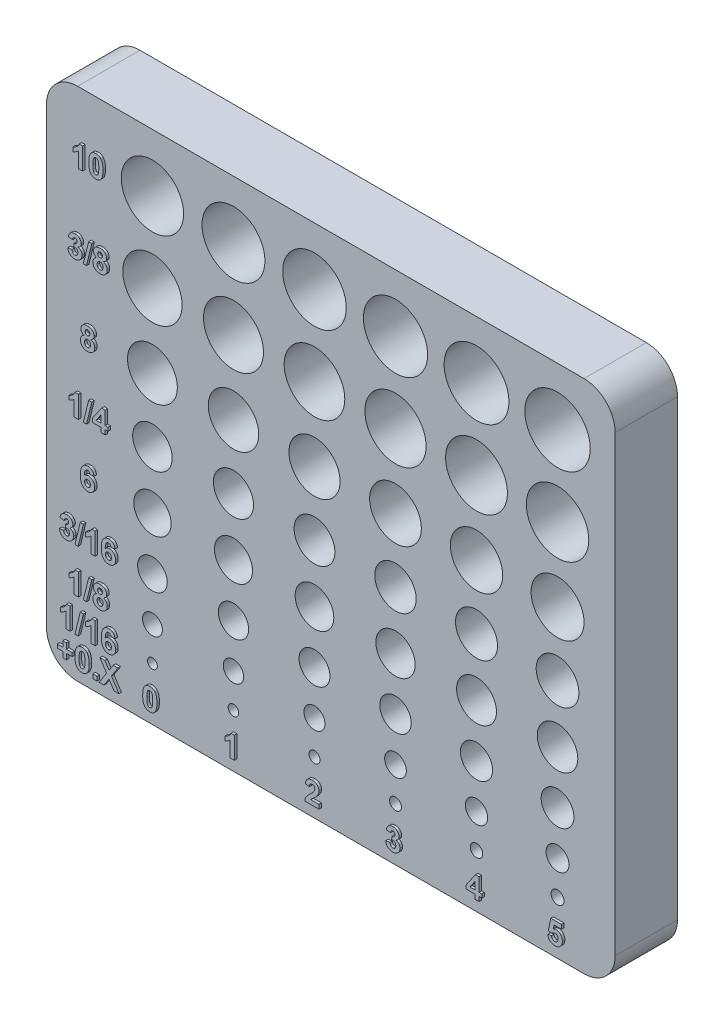
from build123d import *

# Parameters (mm, degrees)
BOSS_EXTRUDE1_DEPTH    = 10
SKETCH1_R              = 0.79375
SKETCH1_R_2            = 1.5875
SKETCH1_R_3            = 2.38125
SKETCH1_R_4            = 3
SKETCH1_R_5            = 3.175
SKETCH1_R_6            = 4
SKETCH1_R_7            = 4.7625
SKETCH1_R_8            = 5
SKETCH1_R_9            = 0.84375
SKETCH1_R_10           = 1.6375
SKETCH1_R_11           = 2.43125
SKETCH1_R_12           = 3.05
SKETCH1_R_13           = 3.225
SKETCH1_R_14           = 4.05
SKETCH1_R_15           = 4.8125
SKETCH1_R_16           = 5.05
SKETCH1_R_17           = 0.89375
SKETCH1_R_18           = 1.6875
SKETCH1_R_19           = 2.48125
SKETCH1_R_20           = 3.1
SKETCH1_R_21           = 3.275
SKETCH1_R_22           = 4.1
SKETCH1_R_23           = 4.8625
SKETCH1_R_24           = 5.1
SKETCH1_R_25           = 0.94375
SKETCH1_R_26           = 1.7375
SKETCH1_R_27           = 2.53125
SKETCH1_R_28           = 3.15
SKETCH1_R_29           = 3.325
SKETCH1_R_30           = 4.15
SKETCH1_R_31           = 4.9125
SKETCH1_R_32           = 5.15
SKETCH1_R_33           = 0.99375
SKETCH1_R_34           = 1.7875
SKETCH1_R_35           = 2.58125
SKETCH1_R_36           = 3.2
SKETCH1_R_37           = 3.375
SKETCH1_R_38           = 4.2
SKETCH1_R_39           = 4.9625
SKETCH1_R_40           = 5.2
SKETCH1_R_41           = 1.04375
SKETCH1_R_42           = 1.8375
SKETCH1_R_43           = 2.63125
SKETCH1_R_44           = 3.25
SKETCH1_R_45           = 3.425
SKETCH1_R_46           = 4.25
SKETCH1_R_47           = 5.0125
SKETCH1_R_48           = 5.25
CUT_EXTRUDE1_DEPTH     = 106.44965642
BOSS_EXTRUDE2_DEPTH    = 0.4
BOSS_EXTRUDE2_2_DEPTH  = 0.4
BOSS_EXTRUDE2_3_DEPTH  = 0.4
BOSS_EXTRUDE2_4_DEPTH  = 0.4
BOSS_EXTRUDE2_5_DEPTH  = 0.4
BOSS_EXTRUDE2_6_DEPTH  = 0.4
BOSS_EXTRUDE2_7_DEPTH  = 0.4
BOSS_EXTRUDE2_8_DEPTH  = 0.4
BOSS_EXTRUDE2_9_DEPTH  = 0.4
BOSS_EXTRUDE2_10_DEPTH = 0.4
BOSS_EXTRUDE2_11_DEPTH = 0.4
BOSS_EXTRUDE2_12_DEPTH = 0.4
BOSS_EXTRUDE2_13_DEPTH = 0.4
BOSS_EXTRUDE2_14_DEPTH = 0.4
BOSS_EXTRUDE2_15_DEPTH = 0.4
BOSS_EXTRUDE2_16_DEPTH = 0.4
BOSS_EXTRUDE2_17_DEPTH = 0.4
BOSS_EXTRUDE2_18_DEPTH = 0.4
BOSS_EXTRUDE2_19_DEPTH = 0.4
BOSS_EXTRUDE2_20_DEPTH = 0.4
BOSS_EXTRUDE2_21_DEPTH = 0.4
BOSS_EXTRUDE3_DEPTH    = 0.4
BOSS_EXTRUDE3_2_DEPTH  = 0.4
BOSS_EXTRUDE3_3_DEPTH  = 0.4
BOSS_EXTRUDE3_4_DEPTH  = 0.4
BOSS_EXTRUDE3_5_DEPTH  = 0.4
BOSS_EXTRUDE3_6_DEPTH  = 0.4
BOSS_EXTRUDE3_7_DEPTH  = 0.4
BOSS_EXTRUDE3_8_DEPTH  = 0.4
SKETCH3_W              = 0.673076923
SKETCH3_H              = 0.673076923
BOSS_EXTRUDE3_9_DEPTH  = 0.4
BOSS_EXTRUDE3_10_DEPTH = 0.4


with BuildPart() as part:
    # Sketch4 → Boss-Extrude1 (new body)
    with BuildSketch(Plane.XY):
        with BuildLine():
            Line((-12, 74.20625), (69.25, 74.20625))
            ThreePointArc((69.25, 74.20625), (72.785533906, 72.741783906), (74.25, 69.20625))
            Line((74.25, 69.20625), (74.25, -3.5))
            ThreePointArc((74.25, -3.5), (72.785533906, -7.035533906), (69.25, -8.5))
            Line((69.25, -8.5), (-12, -8.5))
            ThreePointArc((-12, -8.5), (-15.535533906, -7.035533906), (-17, -3.5))
            Line((-17, -3.5), (-17, 69.20625))
            ThreePointArc((-17, 69.20625), (-15.535533906, 72.741783906), (-12, 74.20625))
        make_face()
    extrude(amount=-BOSS_EXTRUDE1_DEPTH)

    # Sketch1 → Cut-Extrude1 (cut, through all)
    with BuildSketch(Plane.XY):
        Circle(SKETCH1_R)
        with Locations((0, 5.43125)):
            Circle(SKETCH1_R_2)
        with Locations((0, 12.45)):
            Circle(SKETCH1_R_3)
        with Locations((0, 20.88125)):
            Circle(SKETCH1_R_4)
        with Locations((0, 30.10625)):
            Circle(SKETCH1_R_5)
        with Locations((0, 40.33125)):
            Circle(SKETCH1_R_6)
        with Locations((0, 52.14375)):
            Circle(SKETCH1_R_7)
        with Locations((0, 64.95625)):
            Circle(SKETCH1_R_8)
        with Locations((13, 0)):
            Circle(SKETCH1_R_9)
        with Locations((13, 5.43125)):
            Circle(SKETCH1_R_10)
        with Locations((13, 12.45)):
            Circle(SKETCH1_R_11)
        with Locations((13, 20.88125)):
            Circle(SKETCH1_R_12)
        with Locations((13, 30.10625)):
            Circle(SKETCH1_R_13)
        with Locations((13, 40.33125)):
            Circle(SKETCH1_R_14)
        with Locations((13, 52.14375)):
            Circle(SKETCH1_R_15)
        with Locations((13, 64.95625)):
            Circle(SKETCH1_R_16)
        with Locations((26, 0)):
            Circle(SKETCH1_R_17)
        with Locations((26, 5.43125)):
            Circle(SKETCH1_R_18)
        with Locations((26, 12.45)):
            Circle(SKETCH1_R_19)
        with Locations((26, 20.88125)):
            Circle(SKETCH1_R_20)
        with Locations((26, 30.10625)):
            Circle(SKETCH1_R_21)
        with Locations((26, 40.33125)):
            Circle(SKETCH1_R_22)
        with Locations((26, 52.14375)):
            Circle(SKETCH1_R_23)
        with Locations((26, 64.95625)):
            Circle(SKETCH1_R_24)
        with Locations((39, 0)):
            Circle(SKETCH1_R_25)
        with Locations((39, 5.43125)):
            Circle(SKETCH1_R_26)
        with Locations((39, 12.45)):
            Circle(SKETCH1_R_27)
        with Locations((39, 20.88125)):
            Circle(SKETCH1_R_28)
        with Locations((39, 30.10625)):
            Circle(SKETCH1_R_29)
        with Locations((39, 40.33125)):
            Circle(SKETCH1_R_30)
        with Locations((39, 52.14375)):
            Circle(SKETCH1_R_31)
        with Locations((39, 64.95625)):
            Circle(SKETCH1_R_32)
        with Locations((52, 0)):
            Circle(SKETCH1_R_33)
        with Locations((52, 5.43125)):
            Circle(SKETCH1_R_34)
        with Locations((52, 12.45)):
            Circle(SKETCH1_R_35)
        with Locations((52, 20.88125)):
            Circle(SKETCH1_R_36)
        with Locations((52, 30.10625)):
            Circle(SKETCH1_R_37)
        with Locations((52, 40.33125)):
            Circle(SKETCH1_R_38)
        with Locations((52, 52.14375)):
            Circle(SKETCH1_R_39)
        with Locations((52, 64.95625)):
            Circle(SKETCH1_R_40)
        with Locations((65, 0)):
            Circle(SKETCH1_R_41)
        with Locations((65, 5.43125)):
            Circle(SKETCH1_R_42)
        with Locations((65, 12.45)):
            Circle(SKETCH1_R_43)
        with Locations((65, 20.88125)):
            Circle(SKETCH1_R_44)
        with Locations((65, 30.10625)):
            Circle(SKETCH1_R_45)
        with Locations((65, 40.33125)):
            Circle(SKETCH1_R_46)
        with Locations((65, 52.14375)):
            Circle(SKETCH1_R_47)
        with Locations((65, 64.95625)):
            Circle(SKETCH1_R_48)
    extrude(amount=-CUT_EXTRUDE1_DEPTH, mode=Mode.SUBTRACT)


with BuildPart() as body_2:
    # Sketch2 → Boss-Extrude2 (new body)
    with BuildSketch(Plane.XY):
        with BuildLine():
            Line((-12.826923077, -1.75), (-13.5, -1.75))
            Line((-13.5, -1.75), (-13.5, 0.741786859))
            add(Edge.make_bspline(
                [(-13.5, 0.741786859), (-13.530507462, 0.710816094), (-13.591108519, 0.649294716), (-13.687897955, 0.563480597), (-13.788380145, 0.48365084), (-13.893549454, 0.410563683), (-14.002031049, 0.343177762), (-14.114933553, 0.282024779), (-14.231438607, 0.226258595), (-14.312146702, 0.19509396), (-14.352564103, 0.179487179)],
                knots=[0, 0, 0, 0, 1.012567276, 2.011397996, 3.011400399, 4.000747768, 4.993445519, 5.985067596, 6.990952157, 8, 8, 8, 8], degree=3))
            Line((-14.352564103, 0.179487179), (-14.352564103, 0.852564103))
            add(Edge.make_bspline(
                [(-14.352564103, 0.852564103), (-14.307739171, 0.869371528), (-14.213924076, 0.904548163), (-14.075484545, 0.979370648), (-13.930984941, 1.072008434), (-13.809597025, 1.162864649), (-13.713220009, 1.243643084), (-13.645859803, 1.308576272), (-13.583446698, 1.375071224), (-13.52832668, 1.445274154), (-13.479052823, 1.517765713), (-13.435394036, 1.592427475), (-13.396964268, 1.669495291), (-13.376846554, 1.723163608), (-13.366786859, 1.75)],
                knots=[0, 0, 0, 0, 1.253673617, 2.623841347, 4.114270668, 5.751233548, 6.594491912, 7.409089316, 8.202422231, 8.983165545, 9.746111525, 10.498431446, 11.249153235, 12, 12, 12, 12], degree=3))
            Line((-13.366786859, 1.75), (-12.826923077, 1.75))
            Line((-12.826923077, 1.75), (-12.826923077, -1.75))
        make_face()
    extrude(amount=BOSS_EXTRUDE2_DEPTH)


with BuildPart() as body_3:
    # Sketch2 → Boss-Extrude2 2 (new body)
    with BuildSketch(Plane.XY):
        Polygon((-12.033253205, -1.75), (-11.179987981, 1.75), (-10.673076923, 1.75), (-11.525641026, -1.75), align=None)
    extrude(amount=BOSS_EXTRUDE2_2_DEPTH)


with BuildPart() as body_4:
    # Sketch2 → Boss-Extrude2 3 (new body)
    with BuildSketch(Plane.XY):
        with BuildLine():
            Line((-8.788461538, -1.75), (-9.461538462, -1.75))
            Line((-9.461538462, -1.75), (-9.461538462, 0.741786859))
            add(Edge.make_bspline(
                [(-9.461538462, 0.741786859), (-9.492045923, 0.710816094), (-9.552646981, 0.649294716), (-9.649436416, 0.563480597), (-9.749918606, 0.48365084), (-9.855087915, 0.410563683), (-9.963569511, 0.343177762), (-10.076472014, 0.282024779), (-10.192977068, 0.226258595), (-10.273685164, 0.19509396), (-10.314102564, 0.179487179)],
                knots=[0, 0, 0, 0, 1.012567276, 2.011397996, 3.011400399, 4.000747768, 4.993445519, 5.985067596, 6.990952157, 8, 8, 8, 8], degree=3))
            Line((-10.314102564, 0.179487179), (-10.314102564, 0.852564103))
            add(Edge.make_bspline(
                [(-10.314102564, 0.852564103), (-10.269277632, 0.869371528), (-10.175462537, 0.904548163), (-10.037023006, 0.979370648), (-9.892523402, 1.072008434), (-9.771135486, 1.162864649), (-9.674758471, 1.243643084), (-9.607398264, 1.308576272), (-9.54498516, 1.375071224), (-9.489865142, 1.445274154), (-9.440591284, 1.517765713), (-9.396932498, 1.592427475), (-9.35850273, 1.669495291), (-9.338385015, 1.723163608), (-9.328325321, 1.75)],
                knots=[0, 0, 0, 0, 1.253673617, 2.623841347, 4.114270668, 5.751233548, 6.594491912, 7.409089316, 8.202422231, 8.983165545, 9.746111525, 10.498431446, 11.249153235, 12, 12, 12, 12], degree=3))
            Line((-9.328325321, 1.75), (-8.788461538, 1.75))
            Line((-8.788461538, 1.75), (-8.788461538, -1.75))
        make_face()
    extrude(amount=BOSS_EXTRUDE2_3_DEPTH)


with BuildPart() as body_5:
    # Sketch2 → Boss-Extrude2 4 (new body)
    with BuildSketch(Plane.XY):
        with BuildLine():
            Line((-5.602564103, 0.836438301), (-6.275641026, 0.762820513))
            add(Edge.make_bspline(
                [(-6.275641026, 0.762820513), (-6.280150422, 0.795238875), (-6.288636282, 0.856244312), (-6.313770963, 0.940431774), (-6.348761282, 1.011254916), (-6.393674749, 1.068812763), (-6.44717142, 1.113111673), (-6.508127988, 1.14458875), (-6.576505711, 1.16327431), (-6.624445962, 1.165507225), (-6.649338942, 1.166666667)],
                knots=[0, 0, 0, 0, 1.280716388, 2.410074291, 3.425374506, 4.35753932, 5.248331359, 6.12451615, 7.026154803, 8, 8, 8, 8], degree=3))
            add(Edge.make_bspline(
                [(-6.649338942, 1.166666667), (-6.666219563, 1.166253899), (-6.699811144, 1.165432512), (-6.748741364, 1.155004163), (-6.795915981, 1.139528424), (-6.840949984, 1.117610303), (-6.88406807, 1.089329032), (-6.924614739, 1.054346571), (-6.964454091, 1.014506926), (-7.001241214, 0.966398686), (-7.036534179, 0.909435155), (-7.066922848, 0.839701049), (-7.09400829, 0.757261154), (-7.117199224, 0.661711703), (-7.138244759, 0.553659181), (-7.155496123, 0.43266618), (-7.169300562, 0.298623993), (-7.175923089, 0.204750048), (-7.179387019, 0.155649038)],
                knots=[0, 0, 0, 0, 0.642458078, 1.278459126, 1.898279436, 2.531842133, 3.181731979, 3.858193002, 4.57010051, 5.325711302, 6.161524323, 7.118599443, 8.217371811, 9.466325973, 10.864147948, 12.412648259, 14.123626419, 16, 16, 16, 16], degree=3))
            add(Edge.make_bspline(
                [(-7.179387019, 0.155649038), (-7.157875389, 0.179013503), (-7.115693344, 0.224828762), (-7.04570002, 0.284561332), (-6.972371598, 0.335628689), (-6.894910161, 0.377524932), (-6.812892897, 0.408702904), (-6.727805483, 0.432375738), (-6.638534121, 0.445636098), (-6.57786568, 0.447678182), (-6.54697516, 0.448717949)],
                knots=[0, 0, 0, 0, 1.057745406, 2.074127497, 3.059409796, 4.031705469, 5.000875988, 5.977809597, 6.970362319, 8, 8, 8, 8], degree=3))
            add(Edge.make_bspline(
                [(-6.54697516, 0.448717949), (-6.512112634, 0.44771391), (-6.443271527, 0.44573129), (-6.341852595, 0.431825597), (-6.244534469, 0.406820664), (-6.150876899, 0.372995296), (-6.060416988, 0.330400724), (-5.974885141, 0.276482356), (-5.89293873, 0.21361596), (-5.815704762, 0.141791867), (-5.744745318, 0.062719572), (-5.682095147, -0.022684761), (-5.630536116, -0.11468194), (-5.58645932, -0.211212285), (-5.553664501, -0.314181412), (-5.529858929, -0.422107596), (-5.515648679, -0.535981512), (-5.513778067, -0.613674799), (-5.512820513, -0.653445513)],
                knots=[0, 0, 0, 0, 0.99135015, 1.957564468, 2.903754199, 3.843479786, 4.78583385, 5.741106244, 6.712813504, 7.719198368, 8.735844933, 9.730198001, 10.724351158, 11.729813921, 12.742848014, 13.790983496, 14.86921809, 16, 16, 16, 16], degree=3))
            add(Edge.make_bspline(
                [(-5.512820513, -0.653445513), (-5.513792044, -0.695548264), (-5.515686761, -0.77765872), (-5.52963321, -0.897911424), (-5.554268565, -1.011416438), (-5.587925778, -1.119084418), (-5.631460404, -1.220062212), (-5.684199071, -1.315181983), (-5.747926497, -1.402818211), (-5.819750585, -1.484149728), (-5.899820229, -1.556727579), (-5.985151733, -1.620996121), (-6.076691545, -1.674420682), (-6.173086594, -1.719386599), (-6.275992534, -1.752385681), (-6.383595153, -1.777133334), (-6.496769397, -1.792227189), (-6.574038581, -1.793976547), (-6.613581731, -1.794871795)],
                knots=[0, 0, 0, 0, 1.13287417, 2.209376133, 3.25169942, 4.254157582, 5.240146322, 6.205890558, 7.174579019, 8.150183866, 9.1206468, 10.07783463, 11.019441811, 11.967766696, 12.934309213, 13.921380422, 14.936249089, 16, 16, 16, 16], degree=3))
            add(Edge.make_bspline(
                [(-6.613581731, -1.794871795), (-6.655951449, -1.793686408), (-6.739257855, -1.791355725), (-6.861209177, -1.772175393), (-6.977150112, -1.739725304), (-7.087066253, -1.694407371), (-7.191871189, -1.637404428), (-7.290591731, -1.56659638), (-7.382966273, -1.482658469), (-7.470216613, -1.386727407), (-7.549612085, -1.275919451), (-7.617225947, -1.147848758), (-7.674569276, -1.003917956), (-7.721255147, -0.843757917), (-7.757293269, -0.667381347), (-7.782439854, -0.474773455), (-7.799142441, -0.266252768), (-7.800551978, -0.121796538), (-7.801282051, -0.04697516)],
                knots=[0, 0, 0, 0, 0.852151446, 1.675481364, 2.476404467, 3.269281233, 4.062617998, 4.871616733, 5.707301388, 6.56955125, 7.476395267, 8.442009786, 9.475854496, 10.58877921, 11.794095973, 13.094195288, 14.494932947, 16, 16, 16, 16], degree=3))
            add(Edge.make_bspline(
                [(-7.801282051, -0.04697516), (-7.800235595, 0.029712035), (-7.798213588, 0.177890179), (-7.781942696, 0.391839128), (-7.756097818, 0.58941189), (-7.718448278, 0.770162926), (-7.670291607, 0.93446728), (-7.611909423, 1.082655143), (-7.541834983, 1.214190037), (-7.460362481, 1.328644193), (-7.37071925, 1.428134981), (-7.274397205, 1.514012422), (-7.171764069, 1.587106924), (-7.062822306, 1.647233909), (-6.946677592, 1.69281584), (-6.824431597, 1.725731694), (-6.695878991, 1.74688619), (-6.607822488, 1.748951225), (-6.563100962, 1.75)],
                knots=[0, 0, 0, 0, 1.491699013, 2.882321987, 4.171520357, 5.365488089, 6.470299549, 7.49861535, 8.458736801, 9.361983288, 10.224742848, 11.058789056, 11.867429157, 12.671146298, 13.473202851, 14.288259215, 15.130652936, 16, 16, 16, 16], degree=3))
            add(Edge.make_bspline(
                [(-6.563100962, 1.75), (-6.531512528, 1.749431707), (-6.46976118, 1.748320768), (-6.37925569, 1.736523516), (-6.292914294, 1.718483606), (-6.210510697, 1.693512184), (-6.132625077, 1.660070618), (-6.05894815, 1.619331048), (-5.989232228, 1.571403809), (-5.923840048, 1.516597472), (-5.863297909, 1.454746167), (-5.808629758, 1.385709955), (-5.759473557, 1.310322015), (-5.715614171, 1.228644914), (-5.678825642, 1.139896389), (-5.647199831, 1.044774337), (-5.6211898, 0.9430744), (-5.608867333, 0.872525644), (-5.602564103, 0.836438301)],
                knots=[0, 0, 0, 0, 1.036027791, 2.025301876, 2.989435482, 3.928225244, 4.845595412, 5.765526461, 6.686607585, 7.61747015, 8.561102691, 9.521661062, 10.50224679, 11.510949117, 12.559251378, 13.650572309, 14.798212656, 16, 16, 16, 16], degree=3))
        make_face()
        with BuildLine():
            add(Edge.make_bspline(
                [(-7.128205128, -0.638020833), (-7.127949574, -0.660250003), (-7.127450237, -0.703684527), (-7.119262014, -0.766711187), (-7.107492147, -0.82579755), (-7.09163879, -0.881271731), (-7.069664962, -0.932294155), (-7.043594947, -0.979888206), (-7.012757729, -1.023622627), (-6.965441748, -1.074935873), (-6.900060091, -1.128830327), (-6.81425626, -1.176823151), (-6.722319767, -1.206656156), (-6.658905028, -1.209900977), (-6.626903045, -1.211538462)],
                knots=[0, 0, 0, 0, 0.93816693, 1.833124408, 2.679057427, 3.481731691, 4.264557977, 5.020023694, 5.770442996, 6.518065735, 7.962605608, 9.32780964, 10.651490302, 12, 12, 12, 12], degree=3))
            add(Edge.make_bspline(
                [(-6.626903045, -1.211538462), (-6.596587347, -1.210177847), (-6.537581131, -1.207529557), (-6.453318869, -1.18332615), (-6.376779334, -1.145154871), (-6.320669919, -1.100341409), (-6.28154604, -1.056754822), (-6.255255687, -1.01853062), (-6.233855314, -0.97492632), (-6.216359415, -0.926660074), (-6.202266599, -0.873918575), (-6.192644772, -0.816171893), (-6.187187146, -0.753578178), (-6.186337555, -0.710247396), (-6.185897436, -0.687800481)],
                knots=[0, 0, 0, 0, 1.399678333, 2.724321989, 4.020062797, 5.33532049, 6.016755754, 6.724441967, 7.473839083, 8.257094862, 9.096253071, 9.995581596, 10.961638663, 12, 12, 12, 12], degree=3))
            add(Edge.make_bspline(
                [(-6.185897436, -0.687800481), (-6.186272854, -0.664648532), (-6.186998649, -0.619888856), (-6.193349925, -0.555196227), (-6.203740392, -0.495390502), (-6.218267074, -0.440049089), (-6.237930493, -0.389912236), (-6.261128476, -0.343968683), (-6.28929287, -0.303464286), (-6.331149818, -0.2558259), (-6.392011438, -0.207823767), (-6.473334035, -0.164101448), (-6.564488034, -0.139314979), (-6.62792723, -0.136211596), (-6.660556891, -0.134615385)],
                knots=[0, 0, 0, 0, 1.008384627, 1.949510571, 2.828269698, 3.650667555, 4.437180943, 5.170285793, 5.887596972, 6.580056709, 7.926803404, 9.238379296, 10.579573008, 12, 12, 12, 12], degree=3))
            add(Edge.make_bspline(
                [(-6.660556891, -0.134615385), (-6.692281203, -0.135907635), (-6.75389479, -0.138417388), (-6.842440804, -0.16362068), (-6.923461322, -0.203723466), (-6.983137824, -0.250836181), (-7.025198915, -0.295238412), (-7.052747102, -0.333043806), (-7.076726449, -0.37420421), (-7.095663514, -0.419783918), (-7.110263699, -0.468927593), (-7.120735472, -0.521971053), (-7.127072302, -0.578738394), (-7.127820739, -0.617905184), (-7.128205128, -0.638020833)],
                knots=[0, 0, 0, 0, 1.469034193, 2.853094746, 4.235454457, 5.641396914, 6.354997179, 7.06867986, 7.807229614, 8.560602297, 9.353235934, 10.182779392, 11.06669468, 12, 12, 12, 12], degree=3))
        make_face(mode=Mode.SUBTRACT)
    extrude(amount=BOSS_EXTRUDE2_4_DEPTH)


with BuildPart() as body_6:
    # Sketch2 → Boss-Extrude2 5 (new body)
    with BuildSketch(Plane.XY):
        with BuildLine():
            add(Edge.make_bspline(
                [(-10.571414263, 40.484094551), (-10.592814674, 40.493156145), (-10.634821058, 40.510942943), (-10.694462092, 40.542040299), (-10.749752902, 40.575205909), (-10.799824866, 40.611761104), (-10.846752753, 40.649062631), (-10.887757504, 40.690913147), (-10.925262271, 40.734140682), (-10.968044681, 40.795108417), (-11.011687724, 40.875586529), (-11.049194703, 40.97786012), (-11.072508162, 41.084844835), (-11.075438853, 41.157988876), (-11.076923077, 41.195032051)],
                knots=[0, 0, 0, 0, 0.898135024, 1.762928937, 2.598141881, 3.387992021, 4.158483993, 4.912374357, 5.649344587, 6.368826796, 7.78793972, 9.174346042, 10.568971657, 12, 12, 12, 12], degree=3))
            add(Edge.make_bspline(
                [(-11.076923077, 41.195032051), (-11.076128753, 41.226388299), (-11.074568973, 41.287961217), (-11.061870671, 41.378285225), (-11.039830344, 41.464413198), (-11.00989896, 41.546588723), (-10.970954685, 41.624372829), (-10.923397872, 41.69768993), (-10.868108601, 41.767565217), (-10.80323528, 41.831730354), (-10.731233311, 41.891013046), (-10.651101246, 41.942099362), (-10.56369711, 41.985018418), (-10.469519405, 42.021135564), (-10.367617027, 42.047828639), (-10.258910872, 42.067773133), (-10.143013407, 42.078580536), (-10.063355079, 42.080344091), (-10.022435897, 42.08125)],
                knots=[0, 0, 0, 0, 0.969401132, 1.903571386, 2.813295953, 3.714164367, 4.602979607, 5.497068024, 6.412430398, 7.352730811, 8.313282239, 9.291613189, 10.283859467, 11.320059661, 12.405231593, 13.536450991, 14.734515125, 16, 16, 16, 16], degree=3))
            add(Edge.make_bspline(
                [(-10.022435897, 42.08125), (-9.981747909, 42.080361776), (-9.902783723, 42.078637977), (-9.787618704, 42.067617061), (-9.679768495, 42.048054248), (-9.578441694, 42.020905976), (-9.48456112, 41.984815608), (-9.39678279, 41.942538758), (-9.316998996, 41.890555562), (-9.24442843, 41.831797412), (-9.178888568, 41.767574503), (-9.122941926, 41.697688202), (-9.074529145, 41.624575204), (-9.035728818, 41.546562597), (-9.005669368, 41.464428737), (-8.98393634, 41.378216353), (-8.970060018, 41.288030288), (-8.968660859, 41.226400318), (-8.967948718, 41.195032051)],
                knots=[0, 0, 0, 0, 1.259437241, 2.444221022, 3.576496957, 4.648717845, 5.68588583, 6.685544666, 7.658705287, 8.625770615, 9.572078176, 10.492824823, 11.391686538, 12.281331915, 13.183041723, 14.093615956, 15.029693465, 16, 16, 16, 16], degree=3))
            add(Edge.make_bspline(
                [(-8.967948718, 41.195032051), (-8.969484244, 41.156086956), (-8.972505856, 41.079450681), (-8.998859607, 40.968329397), (-9.040335884, 40.863372284), (-9.099900201, 40.766837098), (-9.17364221, 40.678427778), (-9.262743858, 40.601837744), (-9.36427639, 40.534774435), (-9.439712813, 40.50126455), (-9.478365385, 40.484094551)],
                knots=[0, 0, 0, 0, 1.001685467, 1.971119642, 2.924446479, 3.896772127, 4.879289176, 5.877460772, 6.912440485, 8, 8, 8, 8], degree=3))
            add(Edge.make_bspline(
                [(-9.478365385, 40.484094551), (-9.454371353, 40.474156767), (-9.407288977, 40.454656315), (-9.340381964, 40.419948761), (-9.278067159, 40.38193131), (-9.219247676, 40.341624063), (-9.166179749, 40.296294886), (-9.116918812, 40.248592651), (-9.071459395, 40.19785359), (-9.031244454, 40.143404406), (-8.995256871, 40.086168181), (-8.963677727, 40.027049224), (-8.937646081, 39.965185343), (-8.915974243, 39.901730057), (-8.898835684, 39.83590358), (-8.887413308, 39.767843953), (-8.87897802, 39.697645198), (-8.878464809, 39.65001963), (-8.878205128, 39.625921474)],
                knots=[0, 0, 0, 0, 1.114643742, 2.187213659, 3.231772812, 4.247796845, 5.244764516, 6.224002375, 7.19061506, 8.165938012, 9.126385546, 10.091434554, 11.040068535, 12.004700134, 12.968444139, 13.956586669, 14.966049226, 16, 16, 16, 16], degree=3))
            add(Edge.make_bspline(
                [(-8.878205128, 39.625921474), (-8.879203413, 39.586623089), (-8.881164904, 39.509407182), (-8.894924688, 39.396343173), (-8.919777303, 39.289152545), (-8.953685317, 39.187566058), (-8.995967234, 39.090856615), (-9.050092089, 39.000895469), (-9.112698512, 38.916067014), (-9.184779135, 38.837959744), (-9.264590655, 38.767196296), (-9.351088618, 38.705008311), (-9.444426947, 38.653080918), (-9.543838229, 38.609771137), (-9.650060313, 38.577350368), (-9.762349468, 38.553193027), (-9.88092689, 38.539283584), (-9.962103867, 38.537359515), (-10.003505609, 38.536378205)],
                knots=[0, 0, 0, 0, 1.069671731, 2.10175744, 3.09402022, 4.059639235, 5.013663234, 5.960662081, 6.911094837, 7.879078902, 8.847982309, 9.810095429, 10.772776236, 11.750101161, 12.756155452, 13.790512928, 14.873121219, 16, 16, 16, 16], degree=3))
            add(Edge.make_bspline(
                [(-10.003505609, 38.536378205), (-10.04232585, 38.537275059), (-10.118260213, 38.539029351), (-10.229894632, 38.550178668), (-10.336352524, 38.569701399), (-10.438043841, 38.597345173), (-10.53509713, 38.631861586), (-10.626305221, 38.67613076), (-10.713676928, 38.726087504), (-10.766962268, 38.766448835), (-10.793669872, 38.786678686)],
                knots=[0, 0, 0, 0, 1.102600357, 2.156742264, 3.182669202, 4.172953404, 5.147246686, 6.10327948, 7.049328352, 8, 8, 8, 8], degree=3))
            add(Edge.make_bspline(
                [(-10.793669872, 38.786678686), (-10.823585046, 38.811647311), (-10.882639237, 38.860936746), (-10.957911697, 38.946690785), (-11.022970386, 39.037997643), (-11.075562012, 39.13654135), (-11.116589164, 39.242267309), (-11.145709583, 39.354478383), (-11.163865724, 39.47365464), (-11.16571653, 39.555274694), (-11.166666667, 39.597175481)],
                knots=[0, 0, 0, 0, 1.009349607, 1.992511403, 2.949479119, 3.912246635, 4.881480856, 5.884237694, 6.913844069, 8, 8, 8, 8], degree=3))
            add(Edge.make_bspline(
                [(-11.166666667, 39.597175481), (-11.164900213, 39.643575332), (-11.161408821, 39.73528451), (-11.133963928, 39.86990728), (-11.088650451, 39.998314419), (-11.036878505, 40.099956555), (-10.985890112, 40.176229772), (-10.942023352, 40.230669826), (-10.892914473, 40.281705166), (-10.83894797, 40.32957111), (-10.779310325, 40.373253887), (-10.714686713, 40.413629127), (-10.645551985, 40.451993345), (-10.596383755, 40.473282905), (-10.571414263, 40.484094551)],
                knots=[0, 0, 0, 0, 1.466730477, 2.898988729, 4.325053486, 5.763136659, 6.492982434, 7.22372602, 7.971323195, 8.73066801, 9.502396106, 10.306304791, 11.139877329, 12, 12, 12, 12], degree=3))
        make_face()
        with BuildLine():
            add(Edge.make_bspline(
                [(-10.403846154, 41.142447917), (-10.402810561, 41.112184063), (-10.400827099, 41.054219959), (-10.381039198, 40.972540636), (-10.348287298, 40.901194255), (-10.303234537, 40.840709086), (-10.246106945, 40.79309106), (-10.179801671, 40.758986591), (-10.104669556, 40.738973777), (-10.052007512, 40.736425383), (-10.024539263, 40.735096154)],
                knots=[0, 0, 0, 0, 1.15281608, 2.207978909, 3.181172827, 4.129718639, 5.059990565, 5.992992319, 6.953155196, 8, 8, 8, 8], degree=3))
            add(Edge.make_bspline(
                [(-10.024539263, 40.735096154), (-9.996825839, 40.736379741), (-9.943394618, 40.738854486), (-9.867682823, 40.759596479), (-9.800520249, 40.793872907), (-9.743307101, 40.84210194), (-9.697101286, 40.902638906), (-9.663990207, 40.974132311), (-9.643920688, 41.056063529), (-9.642023647, 41.114046997), (-9.641025641, 41.144551282)],
                knots=[0, 0, 0, 0, 1.048069097, 2.020667378, 2.946900928, 3.882892544, 4.829907216, 5.807806237, 6.846717784, 8, 8, 8, 8], degree=3))
            add(Edge.make_bspline(
                [(-9.641025641, 41.144551282), (-9.642017758, 41.173437038), (-9.643915192, 41.228681358), (-9.664420059, 41.306838323), (-9.696570153, 41.376526449), (-9.742836136, 41.43531056), (-9.798356025, 41.484277695), (-9.864520574, 41.517932837), (-9.938642816, 41.539169234), (-9.990964654, 41.541548595), (-10.018229167, 41.542788462)],
                knots=[0, 0, 0, 0, 1.120059371, 2.14212559, 3.117108277, 4.081714894, 5.028368956, 5.970787798, 6.942592912, 8, 8, 8, 8], degree=3))
            add(Edge.make_bspline(
                [(-10.018229167, 41.542788462), (-10.046413649, 41.541537836), (-10.100320182, 41.539145851), (-10.176800763, 41.518241864), (-10.244316935, 41.483485389), (-10.301154201, 41.434437697), (-10.347421236, 41.374912988), (-10.380785494, 41.305448889), (-10.400808627, 41.226755082), (-10.402806035, 41.171316611), (-10.403846154, 41.142447917)],
                knots=[0, 0, 0, 0, 1.078082589, 2.061974896, 3.011033917, 3.963675658, 4.914590949, 5.879605178, 6.895838403, 8, 8, 8, 8], degree=3))
        make_face(mode=Mode.SUBTRACT)
        with BuildLine():
            add(Edge.make_bspline(
                [(-10.493589744, 39.660977564), (-10.493220575, 39.638523819), (-10.492503753, 39.59492502), (-10.485962813, 39.531443259), (-10.475877926, 39.471498133), (-10.460110316, 39.415640752), (-10.441526442, 39.362954492), (-10.417418621, 39.314848969), (-10.390042855, 39.269840995), (-10.357727069, 39.229377629), (-10.322125423, 39.19339401), (-10.284787802, 39.161075806), (-10.24473154, 39.134729826), (-10.202884781, 39.112420866), (-10.15855154, 39.095618862), (-10.112144211, 39.084085503), (-10.063878195, 39.075552098), (-10.030889004, 39.075080738), (-10.014022436, 39.074839744)],
                knots=[0, 0, 0, 0, 1.266244622, 2.458687606, 3.596609786, 4.690452447, 5.728949622, 6.743059962, 7.719893583, 8.695837149, 9.65607124, 10.572687906, 11.475837526, 12.354503287, 13.243297811, 14.141816854, 15.049956288, 16, 16, 16, 16], degree=3))
            add(Edge.make_bspline(
                [(-10.014022436, 39.074839744), (-9.997636707, 39.07516679), (-9.965639579, 39.075805427), (-9.918601049, 39.08310361), (-9.873829783, 39.095143863), (-9.830763332, 39.110956902), (-9.790583258, 39.132472485), (-9.752273126, 39.158008171), (-9.715738329, 39.187978423), (-9.682283879, 39.223360186), (-9.65111985, 39.262389533), (-9.62467337, 39.306463816), (-9.601060536, 39.354031363), (-9.583541228, 39.406370389), (-9.568046456, 39.462131941), (-9.559152258, 39.52241154), (-9.552302081, 39.586502086), (-9.551628732, 39.6305742), (-9.551282051, 39.653265224)],
                knots=[0, 0, 0, 0, 0.942317584, 1.840104704, 2.730710625, 3.607499931, 4.473808274, 5.346669015, 6.254175223, 7.186360584, 8.144194921, 9.122212144, 10.13877185, 11.193666142, 12.293061794, 13.46493029, 14.694790812, 16, 16, 16, 16], degree=3))
            add(Edge.make_bspline(
                [(-9.551282051, 39.653265224), (-9.551668149, 39.673147543), (-9.55242421, 39.712081274), (-9.558867256, 39.769062126), (-9.569320582, 39.823245007), (-9.583867257, 39.874495135), (-9.602971132, 39.922258327), (-9.625613273, 39.967292977), (-9.652794086, 40.009226584), (-9.684559893, 40.047534773), (-9.718503742, 40.082605467), (-9.755453379, 40.11311363), (-9.794632812, 40.139094621), (-9.836252968, 40.160336541), (-9.880134857, 40.176356503), (-9.92584449, 40.188449912), (-9.974062236, 40.1956544), (-10.006986515, 40.196302764), (-10.023838141, 40.196634615)],
                knots=[0, 0, 0, 0, 1.18097333, 2.312592441, 3.401847494, 4.45657129, 5.472467779, 6.453609222, 7.447247299, 8.433973197, 9.406033457, 10.342947316, 11.274909381, 12.193955836, 13.112162788, 14.045055317, 14.999401151, 16, 16, 16, 16], degree=3))
            add(Edge.make_bspline(
                [(-10.023838141, 40.196634615), (-10.043025489, 40.196065931), (-10.080160195, 40.194965313), (-10.134088708, 40.187337993), (-10.184087274, 40.173806778), (-10.230769224, 40.155883877), (-10.273420312, 40.131631141), (-10.312040258, 40.101863859), (-10.347451576, 40.067511707), (-10.387967128, 40.014699294), (-10.430293028, 39.94368265), (-10.46603611, 39.852356219), (-10.489995674, 39.758026036), (-10.492390004, 39.693373408), (-10.493589744, 39.660977564)],
                knots=[0, 0, 0, 0, 0.864439711, 1.673014741, 2.446909759, 3.19383146, 3.919980361, 4.648644137, 5.385779273, 6.135663785, 7.641703236, 9.092511638, 10.543128981, 12, 12, 12, 12], degree=3))
        make_face(mode=Mode.SUBTRACT)
    extrude(amount=BOSS_EXTRUDE2_5_DEPTH)


with BuildPart() as body_7:
    # Sketch2 → Boss-Extrude2 6 (new body)
    with BuildSketch(Plane.XY):
        with BuildLine():
            Line((-11.480769231, 28.35625), (-12.153846154, 28.35625))
            Line((-12.153846154, 28.35625), (-12.153846154, 30.848036859))
            add(Edge.make_bspline(
                [(-12.153846154, 30.848036859), (-12.184353616, 30.817066094), (-12.244954673, 30.755544716), (-12.341744108, 30.669730597), (-12.442226299, 30.58990084), (-12.547395607, 30.516813683), (-12.655877203, 30.449427762), (-12.768779706, 30.388274779), (-12.885284761, 30.332508595), (-12.965992856, 30.30134396), (-13.006410256, 30.285737179)],
                knots=[0, 0, 0, 0, 1.012567276, 2.011397996, 3.011400399, 4.000747768, 4.993445519, 5.985067596, 6.990952157, 8, 8, 8, 8], degree=3))
            Line((-13.006410256, 30.285737179), (-13.006410256, 30.958814103))
            add(Edge.make_bspline(
                [(-13.006410256, 30.958814103), (-12.961585325, 30.975621528), (-12.86777023, 31.010798163), (-12.729330699, 31.085620648), (-12.584831095, 31.178258434), (-12.463443179, 31.269114649), (-12.367066163, 31.349893084), (-12.299705957, 31.414826272), (-12.237292852, 31.481321224), (-12.182172834, 31.551524154), (-12.132898976, 31.624015713), (-12.08924019, 31.698677475), (-12.050810422, 31.775745291), (-12.030692707, 31.829413608), (-12.020633013, 31.85625)],
                knots=[0, 0, 0, 0, 1.253673617, 2.623841347, 4.114270668, 5.751233548, 6.594491912, 7.409089316, 8.202422231, 8.983165545, 9.746111525, 10.498431446, 11.249153235, 12, 12, 12, 12], degree=3))
            Line((-12.020633013, 31.85625), (-11.480769231, 31.85625))
            Line((-11.480769231, 31.85625), (-11.480769231, 28.35625))
        make_face()
    extrude(amount=BOSS_EXTRUDE2_6_DEPTH)


with BuildPart() as body_8:
    # Sketch2 → Boss-Extrude2 7 (new body)
    with BuildSketch(Plane.XY):
        Polygon((-10.687099359, 28.35625), (-9.833834135, 31.85625), (-9.326923077, 31.85625), (-10.179487179, 28.35625), align=None)
    extrude(amount=BOSS_EXTRUDE2_7_DEPTH)


with BuildPart() as body_9:
    # Sketch2 → Boss-Extrude2 8 (new body)
    with BuildSketch(Plane.XY):
        Polygon((-7.846153846, 28.35625), (-7.846153846, 29.074198718), (-9.237179487, 29.074198718), (-9.237179487, 29.655428686), (-7.757111378, 31.811378205), (-7.173076923, 31.811378205), (-7.173076923, 29.657532051), (-6.724358974, 29.657532051), (-6.724358974, 29.074198718), (-7.173076923, 29.074198718), (-7.173076923, 28.35625), align=None)
        Polygon((-7.846153846, 29.657532051), (-7.846153846, 30.822796474), (-8.646133814, 29.657532051), align=None, mode=Mode.SUBTRACT)
    extrude(amount=BOSS_EXTRUDE2_8_DEPTH)


with BuildPart() as body_10:
    # Sketch2 → Boss-Extrude2 9 (new body)
    with BuildSketch(Plane.XY):
        with BuildLine():
            Line((-8.967948718, 21.717688301), (-9.641025641, 21.644070513))
            add(Edge.make_bspline(
                [(-9.641025641, 21.644070513), (-9.645535037, 21.676488875), (-9.654020897, 21.737494312), (-9.679155579, 21.821681774), (-9.714145897, 21.892504916), (-9.759059364, 21.950062763), (-9.812556035, 21.994361673), (-9.873512604, 22.02583875), (-9.941890327, 22.04452431), (-9.989830577, 22.046757225), (-10.014723558, 22.047916667)],
                knots=[0, 0, 0, 0, 1.280716388, 2.410074291, 3.425374506, 4.35753932, 5.248331359, 6.12451615, 7.026154803, 8, 8, 8, 8], degree=3))
            add(Edge.make_bspline(
                [(-10.014723558, 22.047916667), (-10.031604178, 22.047503899), (-10.06519576, 22.046682512), (-10.114125979, 22.036254163), (-10.161300596, 22.020778424), (-10.2063346, 21.998860303), (-10.249452685, 21.970579032), (-10.289999354, 21.935596571), (-10.329838706, 21.895756926), (-10.36662583, 21.847648686), (-10.401918794, 21.790685155), (-10.432307464, 21.720951049), (-10.459392905, 21.638511154), (-10.482583839, 21.542961703), (-10.503629375, 21.434909181), (-10.520880738, 21.31391618), (-10.534685178, 21.179873993), (-10.541307705, 21.086000048), (-10.544771635, 21.036899038)],
                knots=[0, 0, 0, 0, 0.642458078, 1.278459126, 1.898279436, 2.531842133, 3.181731979, 3.858193002, 4.57010051, 5.325711302, 6.161524323, 7.118599443, 8.217371811, 9.466325973, 10.864147948, 12.412648259, 14.123626419, 16, 16, 16, 16], degree=3))
            add(Edge.make_bspline(
                [(-10.544771635, 21.036899038), (-10.523260004, 21.060263503), (-10.48107796, 21.106078762), (-10.411084636, 21.165811332), (-10.337756214, 21.216878689), (-10.260294776, 21.258774932), (-10.178277513, 21.289952904), (-10.093190099, 21.313625738), (-10.003918737, 21.326886098), (-9.943250296, 21.328928182), (-9.912359776, 21.329967949)],
                knots=[0, 0, 0, 0, 1.057745406, 2.074127497, 3.059409796, 4.031705469, 5.000875988, 5.977809597, 6.970362319, 8, 8, 8, 8], degree=3))
            add(Edge.make_bspline(
                [(-9.912359776, 21.329967949), (-9.87749725, 21.32896391), (-9.808656143, 21.32698129), (-9.707237211, 21.313075597), (-9.609919084, 21.288070664), (-9.516261514, 21.254245296), (-9.425801604, 21.211650724), (-9.340269756, 21.157732356), (-9.258323345, 21.09486596), (-9.181089377, 21.023041867), (-9.110129934, 20.943969572), (-9.047479763, 20.858565239), (-8.995920731, 20.76656806), (-8.951843935, 20.670037715), (-8.919049116, 20.567068588), (-8.895243544, 20.459142404), (-8.881033295, 20.345268488), (-8.879162683, 20.267575201), (-8.878205128, 20.227804487)],
                knots=[0, 0, 0, 0, 0.99135015, 1.957564468, 2.903754199, 3.843479786, 4.78583385, 5.741106244, 6.712813504, 7.719198368, 8.735844933, 9.730198001, 10.724351158, 11.729813921, 12.742848014, 13.790983496, 14.86921809, 16, 16, 16, 16], degree=3))
            add(Edge.make_bspline(
                [(-8.878205128, 20.227804487), (-8.879176659, 20.185701736), (-8.881071377, 20.10359128), (-8.895017826, 19.983338576), (-8.91965318, 19.869833562), (-8.953310393, 19.762165582), (-8.996845019, 19.661187788), (-9.049583686, 19.566068017), (-9.113311112, 19.478431789), (-9.1851352, 19.397100272), (-9.265204845, 19.324522421), (-9.350536349, 19.260253879), (-9.442076161, 19.206829318), (-9.538471209, 19.161863401), (-9.64137715, 19.128864319), (-9.748979768, 19.104116666), (-9.862154013, 19.089022811), (-9.939423197, 19.087273453), (-9.978966346, 19.086378205)],
                knots=[0, 0, 0, 0, 1.13287417, 2.209376133, 3.25169942, 4.254157582, 5.240146322, 6.205890558, 7.174579019, 8.150183866, 9.1206468, 10.07783463, 11.019441811, 11.967766696, 12.934309213, 13.921380422, 14.936249089, 16, 16, 16, 16], degree=3))
            add(Edge.make_bspline(
                [(-9.978966346, 19.086378205), (-10.021336065, 19.087563592), (-10.10464247, 19.089894275), (-10.226593793, 19.109074607), (-10.342534727, 19.141524696), (-10.452450868, 19.186842629), (-10.557255805, 19.243845572), (-10.655976347, 19.31465362), (-10.748350888, 19.398591531), (-10.835601229, 19.494522593), (-10.914996701, 19.605330549), (-10.982610562, 19.733401242), (-11.039953891, 19.877332044), (-11.086639762, 20.037492083), (-11.122677885, 20.213868653), (-11.14782447, 20.406476545), (-11.164527056, 20.614997232), (-11.165936594, 20.759453462), (-11.166666667, 20.83427484)],
                knots=[0, 0, 0, 0, 0.852151446, 1.675481364, 2.476404467, 3.269281233, 4.062617998, 4.871616733, 5.707301388, 6.56955125, 7.476395267, 8.442009786, 9.475854496, 10.58877921, 11.794095973, 13.094195288, 14.494932947, 16, 16, 16, 16], degree=3))
            add(Edge.make_bspline(
                [(-11.166666667, 20.83427484), (-11.16562021, 20.910962035), (-11.163598204, 21.059140179), (-11.147327312, 21.273089128), (-11.121482434, 21.47066189), (-11.083832893, 21.651412926), (-11.035676222, 21.81571728), (-10.977294039, 21.963905143), (-10.907219599, 22.095440037), (-10.825747097, 22.209894193), (-10.736103866, 22.309384981), (-10.63978182, 22.395262422), (-10.537148684, 22.468356924), (-10.428206921, 22.528483909), (-10.312062208, 22.57406584), (-10.189816213, 22.606981694), (-10.061263606, 22.62813619), (-9.973207104, 22.630201225), (-9.928485577, 22.63125)],
                knots=[0, 0, 0, 0, 1.491699013, 2.882321987, 4.171520357, 5.365488089, 6.470299549, 7.49861535, 8.458736801, 9.361983288, 10.224742848, 11.058789056, 11.867429157, 12.671146298, 13.473202851, 14.288259215, 15.130652936, 16, 16, 16, 16], degree=3))
            add(Edge.make_bspline(
                [(-9.928485577, 22.63125), (-9.896897144, 22.630681707), (-9.835145795, 22.629570768), (-9.744640305, 22.617773516), (-9.65829891, 22.599733606), (-9.575895312, 22.574762184), (-9.498009692, 22.541320618), (-9.424332765, 22.500581048), (-9.354616843, 22.452653809), (-9.289224664, 22.397847472), (-9.228682524, 22.335996167), (-9.174014373, 22.266959955), (-9.124858172, 22.191572015), (-9.080998787, 22.109894914), (-9.044210258, 22.021146389), (-9.012584446, 21.926024337), (-8.986574416, 21.8243244), (-8.974251949, 21.753775644), (-8.967948718, 21.717688301)],
                knots=[0, 0, 0, 0, 1.036027791, 2.025301876, 2.989435482, 3.928225244, 4.845595412, 5.765526461, 6.686607585, 7.61747015, 8.561102691, 9.521661062, 10.50224679, 11.510949117, 12.559251378, 13.650572309, 14.798212656, 16, 16, 16, 16], degree=3))
        make_face()
        with BuildLine():
            add(Edge.make_bspline(
                [(-10.493589744, 20.243229167), (-10.49333419, 20.220999997), (-10.492834852, 20.177565473), (-10.484646629, 20.114538813), (-10.472876763, 20.05545245), (-10.457023405, 19.999978269), (-10.435049577, 19.948955845), (-10.408979563, 19.901361794), (-10.378142344, 19.857627373), (-10.330826364, 19.806314127), (-10.265444706, 19.752419673), (-10.179640875, 19.704426849), (-10.087704382, 19.674593844), (-10.024289643, 19.671349023), (-9.99228766, 19.669711538)],
                knots=[0, 0, 0, 0, 0.93816693, 1.833124408, 2.679057427, 3.481731691, 4.264557977, 5.020023694, 5.770442996, 6.518065735, 7.962605608, 9.32780964, 10.651490302, 12, 12, 12, 12], degree=3))
            add(Edge.make_bspline(
                [(-9.99228766, 19.669711538), (-9.961971962, 19.671072153), (-9.902965746, 19.673720443), (-9.818703484, 19.69792385), (-9.742163949, 19.736095129), (-9.686054535, 19.780908591), (-9.646930655, 19.824495178), (-9.620640303, 19.86271938), (-9.59923993, 19.90632368), (-9.58174403, 19.954589926), (-9.567651214, 20.007331425), (-9.558029388, 20.065078107), (-9.552571762, 20.127671822), (-9.55172217, 20.171002604), (-9.551282051, 20.193449519)],
                knots=[0, 0, 0, 0, 1.399678333, 2.724321989, 4.020062797, 5.33532049, 6.016755754, 6.724441967, 7.473839083, 8.257094862, 9.096253071, 9.995581596, 10.961638663, 12, 12, 12, 12], degree=3))
            add(Edge.make_bspline(
                [(-9.551282051, 20.193449519), (-9.551657469, 20.216601468), (-9.552383265, 20.261361144), (-9.55873454, 20.326053773), (-9.569125008, 20.385859498), (-9.58365169, 20.441200911), (-9.603315109, 20.491337764), (-9.626513091, 20.537281317), (-9.654677485, 20.577785714), (-9.696534433, 20.6254241), (-9.757396053, 20.673426233), (-9.83871865, 20.717148552), (-9.92987265, 20.741935021), (-9.993311846, 20.745038404), (-10.025941506, 20.746634615)],
                knots=[0, 0, 0, 0, 1.008384627, 1.949510571, 2.828269698, 3.650667555, 4.437180943, 5.170285793, 5.887596972, 6.580056709, 7.926803404, 9.238379296, 10.579573008, 12, 12, 12, 12], degree=3))
            add(Edge.make_bspline(
                [(-10.025941506, 20.746634615), (-10.057665818, 20.745342365), (-10.119279406, 20.742832612), (-10.207825419, 20.71762932), (-10.288845937, 20.677526534), (-10.348522439, 20.630413819), (-10.390583531, 20.586011588), (-10.418131718, 20.548206194), (-10.442111065, 20.50704579), (-10.461048129, 20.461466082), (-10.475648314, 20.412322407), (-10.486120088, 20.359278947), (-10.492456918, 20.302511606), (-10.493205354, 20.263344816), (-10.493589744, 20.243229167)],
                knots=[0, 0, 0, 0, 1.469034193, 2.853094746, 4.235454457, 5.641396914, 6.354997179, 7.06867986, 7.807229614, 8.560602297, 9.353235934, 10.182779392, 11.06669468, 12, 12, 12, 12], degree=3))
        make_face(mode=Mode.SUBTRACT)
    extrude(amount=BOSS_EXTRUDE2_9_DEPTH)


with BuildPart() as body_11:
    # Sketch2 → Boss-Extrude2 10 (new body)
    with BuildSketch(Plane.XY):
        with BuildLine():
            Line((-14.532051282, 11.694190705), (-13.858974359, 11.776923077))
            add(Edge.make_bspline(
                [(-13.858974359, 11.776923077), (-13.853161641, 11.735537005), (-13.842128284, 11.65698041), (-13.807725836, 11.548248114), (-13.762815161, 11.453627605), (-13.70335568, 11.37610003), (-13.634610511, 11.314440802), (-13.557943755, 11.270444699), (-13.474048899, 11.242699919), (-13.415614784, 11.239896103), (-13.385717147, 11.238461538)],
                knots=[0, 0, 0, 0, 1.26631894, 2.403651751, 3.447242243, 4.428907923, 5.348362865, 6.231623936, 7.095215805, 8, 8, 8, 8], degree=3))
            add(Edge.make_bspline(
                [(-13.385717147, 11.238461538), (-13.369565691, 11.238808382), (-13.33757218, 11.239495426), (-13.290540901, 11.246703864), (-13.24535122, 11.258552818), (-13.202449, 11.275602582), (-13.161629433, 11.296787144), (-13.122354994, 11.322015077), (-13.086275524, 11.353523715), (-13.051050308, 11.387997504), (-13.019791052, 11.42724021), (-12.99225537, 11.4698169), (-12.968084508, 11.515305276), (-12.949349613, 11.5648782), (-12.934684394, 11.617461854), (-12.924200166, 11.673284494), (-12.917819473, 11.732135698), (-12.917056201, 11.772466286), (-12.916666667, 11.793048878)],
                knots=[0, 0, 0, 0, 0.951760839, 1.885289532, 2.797832748, 3.70117291, 4.60103766, 5.506897018, 6.445598779, 7.420035506, 8.410036365, 9.396193293, 10.407074535, 11.440988179, 12.514285005, 13.622404236, 14.786601276, 16, 16, 16, 16], degree=3))
            add(Edge.make_bspline(
                [(-12.916666667, 11.793048878), (-12.918125746, 11.831248942), (-12.920909098, 11.904119729), (-12.942416947, 12.007503647), (-12.979715401, 12.098382305), (-13.031972361, 12.175125385), (-13.094068501, 12.236859432), (-13.163628973, 12.283263693), (-13.241311213, 12.309922592), (-13.295314626, 12.313550512), (-13.322616186, 12.315384615)],
                knots=[0, 0, 0, 0, 1.241512862, 2.368321189, 3.414110003, 4.41529485, 5.36642979, 6.245396713, 7.112955941, 8, 8, 8, 8], degree=3))
            add(Edge.make_bspline(
                [(-13.322616186, 12.315384615), (-13.3420532, 12.314887257), (-13.383257618, 12.313832911), (-13.447348859, 12.30287813), (-13.517240635, 12.287760038), (-13.564831622, 12.273217435), (-13.58974359, 12.265604968)],
                knots=[0, 0, 0, 0, 0.854525515, 1.811503923, 2.854410343, 4, 4, 4, 4], degree=3))
            Line((-13.58974359, 12.265604968), (-13.526642628, 12.808974359))
            add(Edge.make_bspline(
                [(-13.526642628, 12.808974359), (-13.507938269, 12.808653502), (-13.471642548, 12.808030879), (-13.418639908, 12.812425286), (-13.369027803, 12.82044849), (-13.322921994, 12.833466094), (-13.28027955, 12.849259107), (-13.24072753, 12.869101851), (-13.205233551, 12.893795122), (-13.162017331, 12.931069484), (-13.117803231, 12.986922883), (-13.077830887, 13.063510439), (-13.055559098, 13.150836446), (-13.052741203, 13.211998944), (-13.051282051, 13.243669872)],
                knots=[0, 0, 0, 0, 0.916749589, 1.778948191, 2.604102396, 3.376994206, 4.124053722, 4.831292757, 5.54010828, 6.238660037, 7.62386988, 9.002523041, 10.447858069, 12, 12, 12, 12], degree=3))
            add(Edge.make_bspline(
                [(-13.051282051, 13.243669872), (-13.052265812, 13.270638578), (-13.054152101, 13.322349121), (-13.071073393, 13.395930831), (-13.099954521, 13.460894375), (-13.140352622, 13.516112111), (-13.18990754, 13.560950603), (-13.247829455, 13.594082982), (-13.3141733, 13.613403573), (-13.360815664, 13.615551972), (-13.385016026, 13.616666667)],
                knots=[0, 0, 0, 0, 1.146968804, 2.199229744, 3.192297141, 4.153502289, 5.090509175, 6.0173182, 6.971286811, 8, 8, 8, 8], degree=3))
            add(Edge.make_bspline(
                [(-13.385016026, 13.616666667), (-13.409277368, 13.615467355), (-13.456966762, 13.613109924), (-13.525206823, 13.589791196), (-13.588161938, 13.553711535), (-13.643715305, 13.502042106), (-13.691864612, 13.437778601), (-13.729176848, 13.359404349), (-13.755453909, 13.268147237), (-13.764484839, 13.202465665), (-13.769230769, 13.167948718)],
                knots=[0, 0, 0, 0, 0.889956214, 1.749345552, 2.62404616, 3.543272128, 4.520224035, 5.562553653, 6.719074424, 8, 8, 8, 8], degree=3))
            Line((-13.769230769, 13.167948718), (-14.442307692, 13.268910256))
            add(Edge.make_bspline(
                [(-14.442307692, 13.268910256), (-14.431209386, 13.320298207), (-14.409964742, 13.418666255), (-14.366558712, 13.556487303), (-14.315628199, 13.678151485), (-14.256123426, 13.785022213), (-14.185638772, 13.878981164), (-14.101951916, 13.960537442), (-14.006314956, 14.032057615), (-13.898910508, 14.091985248), (-13.782130768, 14.140017641), (-13.657848881, 14.175567661), (-13.526381819, 14.195941012), (-13.436501233, 14.198628348), (-13.390625, 14.2)],
                knots=[0, 0, 0, 0, 1.220808349, 2.336900656, 3.3513467, 4.279992853, 5.171472476, 6.069835959, 6.985198729, 7.938095762, 8.919113729, 9.91246339, 10.934493858, 12, 12, 12, 12], degree=3))
            add(Edge.make_bspline(
                [(-13.390625, 14.2), (-13.351313727, 14.199105469), (-13.274506576, 14.197357717), (-13.162503547, 14.182318659), (-13.056529616, 14.157887542), (-12.956437055, 14.123328032), (-12.861761868, 14.07932579), (-12.774084571, 14.023963607), (-12.691565845, 13.960060807), (-12.642689052, 13.910328782), (-12.617988782, 13.885196314)],
                knots=[0, 0, 0, 0, 1.096978699, 2.143298912, 3.148181587, 4.128190255, 5.094201205, 6.055441919, 7.017302331, 8, 8, 8, 8], degree=3))
            add(Edge.make_bspline(
                [(-12.617988782, 13.885196314), (-12.598909388, 13.863779704), (-12.561225605, 13.821479676), (-12.512298288, 13.753661635), (-12.471348757, 13.683192569), (-12.436612965, 13.611542845), (-12.41078128, 13.537050982), (-12.391523552, 13.460886315), (-12.380085142, 13.382373977), (-12.378833585, 13.329243186), (-12.378205128, 13.302564103)],
                knots=[0, 0, 0, 0, 1.065582675, 2.104636323, 3.101288825, 4.092056841, 5.059084899, 6.026073946, 7.008813224, 8, 8, 8, 8], degree=3))
            add(Edge.make_bspline(
                [(-12.378205128, 13.302564103), (-12.379576009, 13.265038177), (-12.382278266, 13.191067678), (-12.407074768, 13.083462561), (-12.446929484, 12.981741923), (-12.502037146, 12.885517191), (-12.573884737, 12.795681294), (-12.66233175, 12.713042562), (-12.76477924, 12.634447461), (-12.841779399, 12.590052351), (-12.881610577, 12.56708734)],
                knots=[0, 0, 0, 0, 0.957571776, 1.887550067, 2.804499428, 3.740591036, 4.709432777, 5.731457079, 6.826512349, 8, 8, 8, 8], degree=3))
            add(Edge.make_bspline(
                [(-12.881610577, 12.56708734), (-12.857909002, 12.561374724), (-12.811137477, 12.55010173), (-12.743570377, 12.527119665), (-12.680293491, 12.497639879), (-12.619757055, 12.465248544), (-12.563463348, 12.426839004), (-12.510321199, 12.384278709), (-12.462362974, 12.335109588), (-12.416408255, 12.283162265), (-12.376237958, 12.226152185), (-12.3399415, 12.16682709), (-12.31078745, 12.103739514), (-12.285851943, 12.03851155), (-12.267271941, 11.970088894), (-12.252722524, 11.898983458), (-12.245429874, 11.824752661), (-12.244207851, 11.774364733), (-12.243589744, 11.748878205)],
                knots=[0, 0, 0, 0, 1.037381978, 2.047118658, 3.030848314, 4.005687143, 4.965748246, 5.927353932, 6.897971669, 7.885165084, 8.876109723, 9.862099733, 10.840989857, 11.829385213, 12.830906716, 13.855042526, 14.915067134, 16, 16, 16, 16], degree=3))
            add(Edge.make_bspline(
                [(-12.243589744, 11.748878205), (-12.244375174, 11.711653801), (-12.245924148, 11.638242271), (-12.262937735, 11.530500468), (-12.288786582, 11.426953518), (-12.324408586, 11.327183096), (-12.372048263, 11.232409897), (-12.429015135, 11.14130434), (-12.49686086, 11.054773935), (-12.574226765, 10.973474424), (-12.658762616, 10.899062424), (-12.74959611, 10.833701628), (-12.845381469, 10.778381953), (-12.94666752, 10.733147819), (-13.052573513, 10.697952583), (-13.164011147, 10.673763121), (-13.280076482, 10.657625015), (-13.359486247, 10.655968104), (-13.399739583, 10.655128205)],
                knots=[0, 0, 0, 0, 1.006520189, 1.984993146, 2.943645202, 3.891894145, 4.845023195, 5.808336607, 6.795092628, 7.815033679, 8.841288157, 9.838185905, 10.83832808, 11.829129029, 12.835072876, 13.85234392, 14.911338897, 16, 16, 16, 16], degree=3))
            add(Edge.make_bspline(
                [(-13.399739583, 10.655128205), (-13.437885412, 10.655767723), (-13.512812801, 10.657023887), (-13.622500256, 10.671905183), (-13.727556349, 10.69379732), (-13.827367884, 10.725823162), (-13.922804299, 10.765270025), (-14.012064266, 10.816120947), (-14.097445473, 10.873917238), (-14.176158432, 10.941620978), (-14.24934446, 11.015411126), (-14.313629619, 11.09655968), (-14.370916266, 11.182476658), (-14.420188265, 11.273923775), (-14.461032714, 11.371138663), (-14.492835769, 11.473870389), (-14.518199317, 11.581804361), (-14.527370333, 11.656212358), (-14.532051282, 11.694190705)],
                knots=[0, 0, 0, 0, 1.077528213, 2.11651914, 3.123276654, 4.10732375, 5.075386463, 6.036572488, 7.005896639, 7.98540975, 8.966414275, 9.939311093, 10.906719916, 11.882103104, 12.870994428, 13.882228509, 14.919075059, 16, 16, 16, 16], degree=3))
        make_face()
    extrude(amount=BOSS_EXTRUDE2_10_DEPTH)


with BuildPart() as body_12:
    # Sketch2 → Boss-Extrude2 11 (new body)
    with BuildSketch(Plane.XY):
        Polygon((-12.033253205, 10.7), (-11.179987981, 14.2), (-10.673076923, 14.2), (-11.525641026, 10.7), align=None)
    extrude(amount=BOSS_EXTRUDE2_11_DEPTH)


with BuildPart() as body_13:
    # Sketch2 → Boss-Extrude2 12 (new body)
    with BuildSketch(Plane.XY):
        with BuildLine():
            Line((-8.788461538, 10.7), (-9.461538462, 10.7))
            Line((-9.461538462, 10.7), (-9.461538462, 13.191786859))
            add(Edge.make_bspline(
                [(-9.461538462, 13.191786859), (-9.492045923, 13.160816094), (-9.552646981, 13.099294716), (-9.649436416, 13.013480597), (-9.749918606, 12.93365084), (-9.855087915, 12.860563683), (-9.963569511, 12.793177762), (-10.076472014, 12.732024779), (-10.192977068, 12.676258595), (-10.273685164, 12.64509396), (-10.314102564, 12.629487179)],
                knots=[0, 0, 0, 0, 1.012567276, 2.011397996, 3.011400399, 4.000747768, 4.993445519, 5.985067596, 6.990952157, 8, 8, 8, 8], degree=3))
            Line((-10.314102564, 12.629487179), (-10.314102564, 13.302564103))
            add(Edge.make_bspline(
                [(-10.314102564, 13.302564103), (-10.269277632, 13.319371528), (-10.175462537, 13.354548163), (-10.037023006, 13.429370648), (-9.892523402, 13.522008434), (-9.771135486, 13.612864649), (-9.674758471, 13.693643084), (-9.607398264, 13.758576272), (-9.54498516, 13.825071224), (-9.489865142, 13.895274154), (-9.440591284, 13.967765713), (-9.396932498, 14.042427475), (-9.35850273, 14.119495291), (-9.338385015, 14.173163608), (-9.328325321, 14.2)],
                knots=[0, 0, 0, 0, 1.253673617, 2.623841347, 4.114270668, 5.751233548, 6.594491912, 7.409089316, 8.202422231, 8.983165545, 9.746111525, 10.498431446, 11.249153235, 12, 12, 12, 12], degree=3))
            Line((-9.328325321, 14.2), (-8.788461538, 14.2))
            Line((-8.788461538, 14.2), (-8.788461538, 10.7))
        make_face()
    extrude(amount=BOSS_EXTRUDE2_12_DEPTH)


with BuildPart() as body_14:
    # Sketch2 → Boss-Extrude2 13 (new body)
    with BuildSketch(Plane.XY):
        with BuildLine():
            Line((-5.602564103, 13.286438301), (-6.275641026, 13.212820513))
            add(Edge.make_bspline(
                [(-6.275641026, 13.212820513), (-6.280150422, 13.245238875), (-6.288636282, 13.306244312), (-6.313770963, 13.390431774), (-6.348761282, 13.461254916), (-6.393674749, 13.518812763), (-6.44717142, 13.563111673), (-6.508127988, 13.59458875), (-6.576505711, 13.61327431), (-6.624445962, 13.615507225), (-6.649338942, 13.616666667)],
                knots=[0, 0, 0, 0, 1.280716388, 2.410074291, 3.425374506, 4.35753932, 5.248331359, 6.12451615, 7.026154803, 8, 8, 8, 8], degree=3))
            add(Edge.make_bspline(
                [(-6.649338942, 13.616666667), (-6.666219563, 13.616253899), (-6.699811144, 13.615432512), (-6.748741364, 13.605004163), (-6.795915981, 13.589528424), (-6.840949984, 13.567610303), (-6.88406807, 13.539329032), (-6.924614739, 13.504346571), (-6.964454091, 13.464506926), (-7.001241214, 13.416398686), (-7.036534179, 13.359435155), (-7.066922848, 13.289701049), (-7.09400829, 13.207261154), (-7.117199224, 13.111711703), (-7.138244759, 13.003659181), (-7.155496123, 12.88266618), (-7.169300562, 12.748623993), (-7.175923089, 12.654750048), (-7.179387019, 12.605649038)],
                knots=[0, 0, 0, 0, 0.642458078, 1.278459126, 1.898279436, 2.531842133, 3.181731979, 3.858193002, 4.57010051, 5.325711302, 6.161524323, 7.118599443, 8.217371811, 9.466325973, 10.864147948, 12.412648259, 14.123626419, 16, 16, 16, 16], degree=3))
            add(Edge.make_bspline(
                [(-7.179387019, 12.605649038), (-7.157875389, 12.629013503), (-7.115693344, 12.674828762), (-7.04570002, 12.734561332), (-6.972371598, 12.785628689), (-6.894910161, 12.827524932), (-6.812892897, 12.858702904), (-6.727805483, 12.882375738), (-6.638534121, 12.895636098), (-6.57786568, 12.897678182), (-6.54697516, 12.898717949)],
                knots=[0, 0, 0, 0, 1.057745406, 2.074127497, 3.059409796, 4.031705469, 5.000875988, 5.977809597, 6.970362319, 8, 8, 8, 8], degree=3))
            add(Edge.make_bspline(
                [(-6.54697516, 12.898717949), (-6.512112634, 12.89771391), (-6.443271527, 12.89573129), (-6.341852595, 12.881825597), (-6.244534469, 12.856820664), (-6.150876899, 12.822995296), (-6.060416988, 12.780400724), (-5.974885141, 12.726482356), (-5.89293873, 12.66361596), (-5.815704762, 12.591791867), (-5.744745318, 12.512719572), (-5.682095147, 12.427315239), (-5.630536116, 12.33531806), (-5.58645932, 12.238787715), (-5.553664501, 12.135818588), (-5.529858929, 12.027892404), (-5.515648679, 11.914018488), (-5.513778067, 11.836325201), (-5.512820513, 11.796554487)],
                knots=[0, 0, 0, 0, 0.99135015, 1.957564468, 2.903754199, 3.843479786, 4.78583385, 5.741106244, 6.712813504, 7.719198368, 8.735844933, 9.730198001, 10.724351158, 11.729813921, 12.742848014, 13.790983496, 14.86921809, 16, 16, 16, 16], degree=3))
            add(Edge.make_bspline(
                [(-5.512820513, 11.796554487), (-5.513792044, 11.754451736), (-5.515686761, 11.67234128), (-5.52963321, 11.552088576), (-5.554268565, 11.438583562), (-5.587925778, 11.330915582), (-5.631460404, 11.229937788), (-5.684199071, 11.134818017), (-5.747926497, 11.047181789), (-5.819750585, 10.965850272), (-5.899820229, 10.893272421), (-5.985151733, 10.829003879), (-6.076691545, 10.775579318), (-6.173086594, 10.730613401), (-6.275992534, 10.697614319), (-6.383595153, 10.672866666), (-6.496769397, 10.657772811), (-6.574038581, 10.656023453), (-6.613581731, 10.655128205)],
                knots=[0, 0, 0, 0, 1.13287417, 2.209376133, 3.25169942, 4.254157582, 5.240146322, 6.205890558, 7.174579019, 8.150183866, 9.1206468, 10.07783463, 11.019441811, 11.967766696, 12.934309213, 13.921380422, 14.936249089, 16, 16, 16, 16], degree=3))
            add(Edge.make_bspline(
                [(-6.613581731, 10.655128205), (-6.655951449, 10.656313592), (-6.739257855, 10.658644275), (-6.861209177, 10.677824607), (-6.977150112, 10.710274696), (-7.087066253, 10.755592629), (-7.191871189, 10.812595572), (-7.290591731, 10.88340362), (-7.382966273, 10.967341531), (-7.470216613, 11.063272593), (-7.549612085, 11.174080549), (-7.617225947, 11.302151242), (-7.674569276, 11.446082044), (-7.721255147, 11.606242083), (-7.757293269, 11.782618653), (-7.782439854, 11.975226545), (-7.799142441, 12.183747232), (-7.800551978, 12.328203462), (-7.801282051, 12.40302484)],
                knots=[0, 0, 0, 0, 0.852151446, 1.675481364, 2.476404467, 3.269281233, 4.062617998, 4.871616733, 5.707301388, 6.56955125, 7.476395267, 8.442009786, 9.475854496, 10.58877921, 11.794095973, 13.094195288, 14.494932947, 16, 16, 16, 16], degree=3))
            add(Edge.make_bspline(
                [(-7.801282051, 12.40302484), (-7.800235595, 12.479712035), (-7.798213588, 12.627890179), (-7.781942696, 12.841839128), (-7.756097818, 13.03941189), (-7.718448278, 13.220162926), (-7.670291607, 13.38446728), (-7.611909423, 13.532655143), (-7.541834983, 13.664190037), (-7.460362482, 13.778644193), (-7.37071925, 13.878134981), (-7.274397205, 13.964012422), (-7.171764069, 14.037106924), (-7.062822306, 14.097233909), (-6.946677592, 14.14281584), (-6.824431597, 14.175731694), (-6.695878991, 14.19688619), (-6.607822488, 14.198951225), (-6.563100962, 14.2)],
                knots=[0, 0, 0, 0, 1.491699013, 2.882321987, 4.171520357, 5.365488089, 6.470299549, 7.49861535, 8.458736801, 9.361983288, 10.224742848, 11.058789056, 11.867429157, 12.671146298, 13.473202851, 14.288259215, 15.130652936, 16, 16, 16, 16], degree=3))
            add(Edge.make_bspline(
                [(-6.563100962, 14.2), (-6.531512528, 14.199431707), (-6.46976118, 14.198320768), (-6.37925569, 14.186523516), (-6.292914294, 14.168483606), (-6.210510697, 14.143512184), (-6.132625077, 14.110070618), (-6.05894815, 14.069331048), (-5.989232228, 14.021403809), (-5.923840048, 13.966597472), (-5.863297909, 13.904746167), (-5.808629758, 13.835709955), (-5.759473557, 13.760322015), (-5.715614171, 13.678644914), (-5.678825642, 13.589896389), (-5.647199831, 13.494774337), (-5.6211898, 13.3930744), (-5.608867333, 13.322525644), (-5.602564103, 13.286438301)],
                knots=[0, 0, 0, 0, 1.036027791, 2.025301876, 2.989435482, 3.928225244, 4.845595412, 5.765526461, 6.686607585, 7.61747015, 8.561102691, 9.521661062, 10.50224679, 11.510949117, 12.559251378, 13.650572309, 14.798212656, 16, 16, 16, 16], degree=3))
        make_face()
        with BuildLine():
            add(Edge.make_bspline(
                [(-7.128205128, 11.811979167), (-7.127949574, 11.789749997), (-7.127450237, 11.746315473), (-7.119262014, 11.683288813), (-7.107492147, 11.62420245), (-7.09163879, 11.568728269), (-7.069664962, 11.517705845), (-7.043594947, 11.470111794), (-7.012757729, 11.426377373), (-6.965441748, 11.375064127), (-6.900060091, 11.321169673), (-6.81425626, 11.273176849), (-6.722319767, 11.243343844), (-6.658905028, 11.240099023), (-6.626903045, 11.238461538)],
                knots=[0, 0, 0, 0, 0.93816693, 1.833124408, 2.679057427, 3.481731691, 4.264557977, 5.020023694, 5.770442996, 6.518065735, 7.962605608, 9.32780964, 10.651490302, 12, 12, 12, 12], degree=3))
            add(Edge.make_bspline(
                [(-6.626903045, 11.238461538), (-6.596587347, 11.239822153), (-6.537581131, 11.242470443), (-6.453318869, 11.26667385), (-6.376779334, 11.304845129), (-6.320669919, 11.349658591), (-6.28154604, 11.393245178), (-6.255255687, 11.43146938), (-6.233855314, 11.47507368), (-6.216359415, 11.523339926), (-6.202266599, 11.576081425), (-6.192644772, 11.633828107), (-6.187187146, 11.696421822), (-6.186337555, 11.739752604), (-6.185897436, 11.762199519)],
                knots=[0, 0, 0, 0, 1.399678333, 2.724321989, 4.020062797, 5.33532049, 6.016755754, 6.724441967, 7.473839083, 8.257094862, 9.096253071, 9.995581596, 10.961638663, 12, 12, 12, 12], degree=3))
            add(Edge.make_bspline(
                [(-6.185897436, 11.762199519), (-6.186272854, 11.785351468), (-6.186998649, 11.830111144), (-6.193349925, 11.894803773), (-6.203740392, 11.954609498), (-6.218267074, 12.009950911), (-6.237930493, 12.060087764), (-6.261128476, 12.106031317), (-6.28929287, 12.146535714), (-6.331149818, 12.1941741), (-6.392011438, 12.242176233), (-6.473334035, 12.285898552), (-6.564488034, 12.310685021), (-6.62792723, 12.313788404), (-6.660556891, 12.315384615)],
                knots=[0, 0, 0, 0, 1.008384627, 1.949510571, 2.828269698, 3.650667555, 4.437180943, 5.170285793, 5.887596972, 6.580056709, 7.926803404, 9.238379296, 10.579573008, 12, 12, 12, 12], degree=3))
            add(Edge.make_bspline(
                [(-6.660556891, 12.315384615), (-6.692281203, 12.314092365), (-6.75389479, 12.311582612), (-6.842440804, 12.28637932), (-6.923461322, 12.246276534), (-6.983137824, 12.199163819), (-7.025198915, 12.154761588), (-7.052747102, 12.116956194), (-7.076726449, 12.07579579), (-7.095663514, 12.030216082), (-7.110263699, 11.981072407), (-7.120735472, 11.928028947), (-7.127072302, 11.871261606), (-7.127820739, 11.832094816), (-7.128205128, 11.811979167)],
                knots=[0, 0, 0, 0, 1.469034193, 2.853094746, 4.235454457, 5.641396914, 6.354997179, 7.06867986, 7.807229614, 8.560602297, 9.353235934, 10.182779392, 11.06669468, 12, 12, 12, 12], degree=3))
        make_face(mode=Mode.SUBTRACT)
    extrude(amount=BOSS_EXTRUDE2_13_DEPTH)


with BuildPart() as body_15:
    # Sketch2 → Boss-Extrude2 14 (new body)
    with BuildSketch(Plane.XY):
        with BuildLine():
            Line((-13.185897436, 51.387940705), (-12.512820513, 51.470673077))
            add(Edge.make_bspline(
                [(-12.512820513, 51.470673077), (-12.507007795, 51.429287005), (-12.495974438, 51.35073041), (-12.46157199, 51.241998114), (-12.416661315, 51.147377605), (-12.357201834, 51.06985003), (-12.288456665, 51.008190802), (-12.211789908, 50.964194699), (-12.127895053, 50.936449919), (-12.069460938, 50.933646103), (-12.039563301, 50.932211538)],
                knots=[0, 0, 0, 0, 1.26631894, 2.403651751, 3.447242243, 4.428907923, 5.348362865, 6.231623936, 7.095215805, 8, 8, 8, 8], degree=3))
            add(Edge.make_bspline(
                [(-12.039563301, 50.932211538), (-12.023411845, 50.932558382), (-11.991418334, 50.933245426), (-11.944387054, 50.940453864), (-11.899197373, 50.952302818), (-11.856295153, 50.969352582), (-11.815475587, 50.990537144), (-11.776201147, 51.015765077), (-11.740121678, 51.047273715), (-11.704896462, 51.081747504), (-11.673637206, 51.12099021), (-11.646101523, 51.1635669), (-11.621930662, 51.209055276), (-11.603195767, 51.2586282), (-11.588530548, 51.311211854), (-11.57804632, 51.367034494), (-11.571665627, 51.425885698), (-11.570902354, 51.466216286), (-11.570512821, 51.486798878)],
                knots=[0, 0, 0, 0, 0.951760839, 1.885289532, 2.797832748, 3.70117291, 4.60103766, 5.506897018, 6.445598779, 7.420035506, 8.410036365, 9.396193293, 10.407074535, 11.440988179, 12.514285005, 13.622404236, 14.786601276, 16, 16, 16, 16], degree=3))
            add(Edge.make_bspline(
                [(-11.570512821, 51.486798878), (-11.571971899, 51.524998942), (-11.574755252, 51.597869729), (-11.596263101, 51.701253647), (-11.633561554, 51.792132305), (-11.685818515, 51.868875385), (-11.747914655, 51.930609432), (-11.817475127, 51.977013693), (-11.895157367, 52.003672592), (-11.94916078, 52.007300512), (-11.97646234, 52.009134615)],
                knots=[0, 0, 0, 0, 1.241512862, 2.368321189, 3.414110003, 4.41529485, 5.36642979, 6.245396713, 7.112955941, 8, 8, 8, 8], degree=3))
            add(Edge.make_bspline(
                [(-11.97646234, 52.009134615), (-11.995899353, 52.008637257), (-12.037103771, 52.007582911), (-12.101195012, 51.99662813), (-12.171086789, 51.981510038), (-12.218677776, 51.966967435), (-12.243589744, 51.959354968)],
                knots=[0, 0, 0, 0, 0.854525515, 1.811503923, 2.854410343, 4, 4, 4, 4], degree=3))
            Line((-12.243589744, 51.959354968), (-12.180488782, 52.502724359))
            add(Edge.make_bspline(
                [(-12.180488782, 52.502724359), (-12.161784422, 52.502403502), (-12.125488702, 52.501780879), (-12.072486062, 52.506175286), (-12.022873957, 52.51419849), (-11.976768147, 52.527216094), (-11.934125704, 52.543009107), (-11.894573684, 52.562851851), (-11.859079705, 52.587545122), (-11.815863485, 52.624819484), (-11.771649385, 52.680672883), (-11.731677041, 52.757260439), (-11.709405252, 52.844586446), (-11.706587357, 52.905748944), (-11.705128205, 52.937419872)],
                knots=[0, 0, 0, 0, 0.916749589, 1.778948191, 2.604102396, 3.376994206, 4.124053722, 4.831292757, 5.54010828, 6.238660037, 7.62386988, 9.002523041, 10.447858069, 12, 12, 12, 12], degree=3))
            add(Edge.make_bspline(
                [(-11.705128205, 52.937419872), (-11.706111965, 52.964388578), (-11.707998255, 53.016099121), (-11.724919547, 53.089680831), (-11.753800674, 53.154644375), (-11.794198776, 53.209862111), (-11.843753694, 53.254700603), (-11.901675609, 53.287832982), (-11.968019453, 53.307153573), (-12.014661818, 53.309301972), (-12.038862179, 53.310416667)],
                knots=[0, 0, 0, 0, 1.146968804, 2.199229744, 3.192297141, 4.153502289, 5.090509175, 6.0173182, 6.971286811, 8, 8, 8, 8], degree=3))
            add(Edge.make_bspline(
                [(-12.038862179, 53.310416667), (-12.063123522, 53.309217355), (-12.110812915, 53.306859924), (-12.179052977, 53.283541196), (-12.242008092, 53.247461535), (-12.297561459, 53.195792106), (-12.345710766, 53.131528601), (-12.383023002, 53.053154349), (-12.409300063, 52.961897237), (-12.418330993, 52.896215665), (-12.423076923, 52.861698718)],
                knots=[0, 0, 0, 0, 0.889956214, 1.749345552, 2.62404616, 3.543272128, 4.520224035, 5.562553653, 6.719074424, 8, 8, 8, 8], degree=3))
            Line((-12.423076923, 52.861698718), (-13.096153846, 52.962660256))
            add(Edge.make_bspline(
                [(-13.096153846, 52.962660256), (-13.08505554, 53.014048207), (-13.063810896, 53.112416255), (-13.020404866, 53.250237303), (-12.969474353, 53.371901485), (-12.90996958, 53.478772213), (-12.839484926, 53.572731164), (-12.75579807, 53.654287442), (-12.66016111, 53.725807615), (-12.552756662, 53.785735248), (-12.435976922, 53.833767641), (-12.311695034, 53.869317661), (-12.180227972, 53.889691012), (-12.090347387, 53.892378348), (-12.044471154, 53.89375)],
                knots=[0, 0, 0, 0, 1.220808349, 2.336900656, 3.3513467, 4.279992853, 5.171472476, 6.069835959, 6.985198729, 7.938095762, 8.919113729, 9.91246339, 10.934493858, 12, 12, 12, 12], degree=3))
            add(Edge.make_bspline(
                [(-12.044471154, 53.89375), (-12.005159881, 53.892855469), (-11.92835273, 53.891107717), (-11.816349701, 53.876068659), (-11.71037577, 53.851637542), (-11.610283209, 53.817078032), (-11.515608022, 53.77307579), (-11.427930725, 53.717713607), (-11.345411999, 53.653810807), (-11.296535206, 53.604078782), (-11.271834936, 53.578946314)],
                knots=[0, 0, 0, 0, 1.096978699, 2.143298912, 3.148181587, 4.128190255, 5.094201205, 6.055441919, 7.017302331, 8, 8, 8, 8], degree=3))
            add(Edge.make_bspline(
                [(-11.271834936, 53.578946314), (-11.252755542, 53.557529704), (-11.215071759, 53.515229676), (-11.166144442, 53.447411635), (-11.125194911, 53.376942569), (-11.090459119, 53.305292845), (-11.064627433, 53.230800982), (-11.045369705, 53.154636315), (-11.033931295, 53.076123977), (-11.032679739, 53.022993186), (-11.032051282, 52.996314103)],
                knots=[0, 0, 0, 0, 1.065582675, 2.104636323, 3.101288825, 4.092056841, 5.059084899, 6.026073946, 7.008813224, 8, 8, 8, 8], degree=3))
            add(Edge.make_bspline(
                [(-11.032051282, 52.996314103), (-11.033422162, 52.958788177), (-11.03612442, 52.884817678), (-11.060920922, 52.777212561), (-11.100775638, 52.675491923), (-11.1558833, 52.579267191), (-11.22773089, 52.489431294), (-11.316177904, 52.406792562), (-11.418625394, 52.328197461), (-11.495625553, 52.283802351), (-11.535456731, 52.26083734)],
                knots=[0, 0, 0, 0, 0.957571776, 1.887550067, 2.804499428, 3.740591036, 4.709432777, 5.731457079, 6.826512349, 8, 8, 8, 8], degree=3))
            add(Edge.make_bspline(
                [(-11.535456731, 52.26083734), (-11.511755156, 52.255124724), (-11.464983631, 52.24385173), (-11.39741653, 52.220869665), (-11.334139645, 52.191389879), (-11.273603209, 52.158998544), (-11.217309502, 52.120589004), (-11.164167352, 52.078028709), (-11.116209128, 52.028859588), (-11.070254409, 51.976912265), (-11.030084111, 51.919902185), (-10.993787654, 51.86057709), (-10.964633603, 51.797489514), (-10.939698097, 51.73226155), (-10.921118095, 51.663838894), (-10.906568678, 51.592733458), (-10.899276028, 51.518502661), (-10.898054005, 51.468114733), (-10.897435897, 51.442628205)],
                knots=[0, 0, 0, 0, 1.037381978, 2.047118658, 3.030848314, 4.005687143, 4.965748246, 5.927353932, 6.897971669, 7.885165084, 8.876109723, 9.862099733, 10.840989857, 11.829385213, 12.830906716, 13.855042526, 14.915067134, 16, 16, 16, 16], degree=3))
            add(Edge.make_bspline(
                [(-10.897435897, 51.442628205), (-10.898221328, 51.405403801), (-10.899770302, 51.331992271), (-10.916783889, 51.224250468), (-10.942632736, 51.120703518), (-10.97825474, 51.020933096), (-11.025894417, 50.926159897), (-11.082861289, 50.83505434), (-11.150707014, 50.748523935), (-11.228072919, 50.667224424), (-11.31260877, 50.592812424), (-11.403442264, 50.527451628), (-11.499227623, 50.472131953), (-11.600513673, 50.426897819), (-11.706419666, 50.391702583), (-11.817857301, 50.367513121), (-11.933922635, 50.351375015), (-12.013332401, 50.349718104), (-12.053585737, 50.348878205)],
                knots=[0, 0, 0, 0, 1.006520189, 1.984993146, 2.943645202, 3.891894145, 4.845023195, 5.808336607, 6.795092628, 7.815033679, 8.841288157, 9.838185905, 10.83832808, 11.829129029, 12.835072876, 13.85234392, 14.911338897, 16, 16, 16, 16], degree=3))
            add(Edge.make_bspline(
                [(-12.053585737, 50.348878205), (-12.091731566, 50.349517723), (-12.166658955, 50.350773887), (-12.27634641, 50.365655183), (-12.381402503, 50.38754732), (-12.481214038, 50.419573162), (-12.576650452, 50.459020025), (-12.66591042, 50.509870947), (-12.751291627, 50.567667238), (-12.830004586, 50.635370978), (-12.903190613, 50.709161126), (-12.967475773, 50.79030968), (-13.02476242, 50.876226658), (-13.074034418, 50.967673775), (-13.114878868, 51.064888663), (-13.146681922, 51.167620389), (-13.172045471, 51.275554361), (-13.181216487, 51.349962358), (-13.185897436, 51.387940705)],
                knots=[0, 0, 0, 0, 1.077528213, 2.11651914, 3.123276654, 4.10732375, 5.075386463, 6.036572488, 7.005896639, 7.98540975, 8.966414275, 9.939311093, 10.906719916, 11.882103104, 12.870994428, 13.882228509, 14.919075059, 16, 16, 16, 16], degree=3))
        make_face()
    extrude(amount=BOSS_EXTRUDE2_14_DEPTH)


with BuildPart() as body_16:
    # Sketch2 → Boss-Extrude2 15 (new body)
    with BuildSketch(Plane.XY):
        Polygon((-10.687099359, 50.39375), (-9.833834135, 53.89375), (-9.326923077, 53.89375), (-10.179487179, 50.39375), align=None)
    extrude(amount=BOSS_EXTRUDE2_15_DEPTH)


with BuildPart() as body_17:
    # Sketch2 → Boss-Extrude2 16 (new body)
    with BuildSketch(Plane.XY):
        with BuildLine():
            add(Edge.make_bspline(
                [(-8.552183494, 52.296594551), (-8.573583905, 52.305656145), (-8.615590289, 52.323442943), (-8.675231323, 52.354540299), (-8.730522133, 52.387705909), (-8.780594097, 52.424261104), (-8.827521984, 52.461562631), (-8.868526735, 52.503413147), (-8.906031502, 52.546640682), (-8.948813912, 52.607608417), (-8.992456954, 52.688086529), (-9.029963934, 52.79036012), (-9.053277393, 52.897344835), (-9.056208084, 52.970488876), (-9.057692308, 53.007532051)],
                knots=[0, 0, 0, 0, 0.898135024, 1.762928937, 2.598141881, 3.387992021, 4.158483993, 4.912374357, 5.649344587, 6.368826796, 7.78793972, 9.174346042, 10.568971657, 12, 12, 12, 12], degree=3))
            add(Edge.make_bspline(
                [(-9.057692308, 53.007532051), (-9.056897984, 53.038888299), (-9.055338204, 53.100461217), (-9.042639901, 53.190785225), (-9.020599575, 53.276913198), (-8.990668191, 53.359088723), (-8.951723916, 53.436872829), (-8.904167103, 53.51018993), (-8.848877832, 53.580065217), (-8.78400451, 53.644230354), (-8.712002541, 53.703513046), (-8.631870477, 53.754599362), (-8.54446634, 53.797518418), (-8.450288636, 53.833635564), (-8.348386258, 53.860328639), (-8.239680103, 53.880273133), (-8.123782637, 53.891080536), (-8.04412431, 53.892844091), (-8.003205128, 53.89375)],
                knots=[0, 0, 0, 0, 0.969401132, 1.903571386, 2.813295953, 3.714164367, 4.602979607, 5.497068024, 6.412430398, 7.352730811, 8.313282239, 9.291613189, 10.283859467, 11.320059661, 12.405231593, 13.536450991, 14.734515125, 16, 16, 16, 16], degree=3))
            add(Edge.make_bspline(
                [(-8.003205128, 53.89375), (-7.96251714, 53.892861776), (-7.883552954, 53.891137977), (-7.768387934, 53.880117061), (-7.660537726, 53.860554248), (-7.559210925, 53.833405976), (-7.465330351, 53.797315608), (-7.37755202, 53.755038758), (-7.297768226, 53.703055562), (-7.225197661, 53.644297412), (-7.159657799, 53.580074503), (-7.103711157, 53.510188202), (-7.055298376, 53.437075204), (-7.016498049, 53.359062597), (-6.986438599, 53.276928737), (-6.96470557, 53.190716353), (-6.950829249, 53.100530288), (-6.949430089, 53.038900318), (-6.948717949, 53.007532051)],
                knots=[0, 0, 0, 0, 1.259437241, 2.444221022, 3.576496957, 4.648717845, 5.68588583, 6.685544666, 7.658705287, 8.625770615, 9.572078176, 10.492824823, 11.391686538, 12.281331915, 13.183041723, 14.093615956, 15.029693465, 16, 16, 16, 16], degree=3))
            add(Edge.make_bspline(
                [(-6.948717949, 53.007532051), (-6.950253475, 52.968586956), (-6.953275087, 52.891950681), (-6.979628837, 52.780829397), (-7.021105115, 52.675872284), (-7.080669432, 52.579337098), (-7.15441144, 52.490927778), (-7.243513088, 52.414337744), (-7.345045621, 52.347274435), (-7.420482044, 52.31376455), (-7.459134615, 52.296594551)],
                knots=[0, 0, 0, 0, 1.001685467, 1.971119642, 2.924446479, 3.896772127, 4.879289176, 5.877460772, 6.912440485, 8, 8, 8, 8], degree=3))
            add(Edge.make_bspline(
                [(-7.459134615, 52.296594551), (-7.435140583, 52.286656767), (-7.388058208, 52.267156315), (-7.321151195, 52.232448761), (-7.25883639, 52.19443131), (-7.200016906, 52.154124063), (-7.14694898, 52.108794886), (-7.097688043, 52.061092651), (-7.052228626, 52.01035359), (-7.012013684, 51.955904406), (-6.976026101, 51.898668181), (-6.944446958, 51.839549224), (-6.918415311, 51.777685343), (-6.896743473, 51.714230057), (-6.879604915, 51.64840358), (-6.868182539, 51.580343953), (-6.85974725, 51.510145198), (-6.85923404, 51.46251963), (-6.858974359, 51.438421474)],
                knots=[0, 0, 0, 0, 1.114643742, 2.187213659, 3.231772812, 4.247796845, 5.244764516, 6.224002375, 7.19061506, 8.165938012, 9.126385546, 10.091434554, 11.040068535, 12.004700134, 12.968444139, 13.956586669, 14.966049226, 16, 16, 16, 16], degree=3))
            add(Edge.make_bspline(
                [(-6.858974359, 51.438421474), (-6.859972643, 51.399123089), (-6.861934135, 51.321907182), (-6.875693919, 51.208843173), (-6.900546534, 51.101652545), (-6.934454548, 51.000066058), (-6.976736465, 50.903356615), (-7.03086132, 50.813395469), (-7.093467742, 50.728567014), (-7.165548366, 50.650459744), (-7.245359886, 50.579696296), (-7.331857849, 50.517508311), (-7.425196178, 50.465580918), (-7.52460746, 50.422271137), (-7.630829543, 50.389850368), (-7.743118699, 50.365693027), (-7.86169612, 50.351783584), (-7.942873098, 50.349859515), (-7.98427484, 50.348878205)],
                knots=[0, 0, 0, 0, 1.069671731, 2.10175744, 3.09402022, 4.059639235, 5.013663234, 5.960662081, 6.911094837, 7.879078902, 8.847982309, 9.810095429, 10.772776236, 11.750101161, 12.756155452, 13.790512928, 14.873121219, 16, 16, 16, 16], degree=3))
            add(Edge.make_bspline(
                [(-7.98427484, 50.348878205), (-8.023095081, 50.349775059), (-8.099029444, 50.351529351), (-8.210663863, 50.362678668), (-8.317121755, 50.382201399), (-8.418813072, 50.409845173), (-8.515866361, 50.444361586), (-8.607074452, 50.48863076), (-8.694446159, 50.538587504), (-8.747731498, 50.578948835), (-8.774439103, 50.599178686)],
                knots=[0, 0, 0, 0, 1.102600357, 2.156742264, 3.182669202, 4.172953404, 5.147246686, 6.10327948, 7.049328352, 8, 8, 8, 8], degree=3))
            add(Edge.make_bspline(
                [(-8.774439103, 50.599178686), (-8.804354276, 50.624147311), (-8.863408468, 50.673436746), (-8.938680928, 50.759190785), (-9.003739617, 50.850497643), (-9.056331243, 50.94904135), (-9.097358395, 51.054767309), (-9.126478814, 51.166978383), (-9.144634955, 51.28615464), (-9.146485761, 51.367774694), (-9.147435897, 51.409675481)],
                knots=[0, 0, 0, 0, 1.009349607, 1.992511403, 2.949479119, 3.912246635, 4.881480856, 5.884237694, 6.913844069, 8, 8, 8, 8], degree=3))
            add(Edge.make_bspline(
                [(-9.147435897, 51.409675481), (-9.145669443, 51.456075332), (-9.142178052, 51.54778451), (-9.114733159, 51.68240728), (-9.069419681, 51.810814419), (-9.017647736, 51.912456555), (-8.966659343, 51.988729772), (-8.922792583, 52.043169826), (-8.873683704, 52.094205166), (-8.819717201, 52.14207111), (-8.760079556, 52.185753887), (-8.695455944, 52.226129127), (-8.626321216, 52.264493345), (-8.577152986, 52.285782905), (-8.552183494, 52.296594551)],
                knots=[0, 0, 0, 0, 1.466730477, 2.898988729, 4.325053486, 5.763136659, 6.492982434, 7.22372602, 7.971323195, 8.73066801, 9.502396106, 10.306304791, 11.139877329, 12, 12, 12, 12], degree=3))
        make_face()
        with BuildLine():
            add(Edge.make_bspline(
                [(-8.384615385, 52.954947917), (-8.383579792, 52.924684063), (-8.38159633, 52.866719959), (-8.361808429, 52.785040636), (-8.329056529, 52.713694255), (-8.284003768, 52.653209086), (-8.226876176, 52.60559106), (-8.160570901, 52.571486591), (-8.085438787, 52.551473777), (-8.032776743, 52.548925383), (-8.005308494, 52.547596154)],
                knots=[0, 0, 0, 0, 1.15281608, 2.207978909, 3.181172827, 4.129718639, 5.059990565, 5.992992319, 6.953155196, 8, 8, 8, 8], degree=3))
            add(Edge.make_bspline(
                [(-8.005308494, 52.547596154), (-7.97759507, 52.548879741), (-7.924163849, 52.551354486), (-7.848452054, 52.572096479), (-7.78128948, 52.606372907), (-7.724076332, 52.65460194), (-7.677870516, 52.715138906), (-7.644759438, 52.786632311), (-7.624689918, 52.868563529), (-7.622792878, 52.926546997), (-7.621794872, 52.957051282)],
                knots=[0, 0, 0, 0, 1.048069097, 2.020667378, 2.946900928, 3.882892544, 4.829907216, 5.807806237, 6.846717784, 8, 8, 8, 8], degree=3))
            add(Edge.make_bspline(
                [(-7.621794872, 52.957051282), (-7.622786989, 52.985937038), (-7.624684423, 53.041181358), (-7.64518929, 53.119338323), (-7.677339384, 53.189026449), (-7.723605367, 53.24781056), (-7.779125256, 53.296777695), (-7.845289805, 53.330432837), (-7.919412046, 53.351669234), (-7.971733884, 53.354048595), (-7.998998397, 53.355288462)],
                knots=[0, 0, 0, 0, 1.120059371, 2.14212559, 3.117108277, 4.081714894, 5.028368956, 5.970787798, 6.942592912, 8, 8, 8, 8], degree=3))
            add(Edge.make_bspline(
                [(-7.998998397, 53.355288462), (-8.02718288, 53.354037836), (-8.081089413, 53.351645851), (-8.157569994, 53.330741864), (-8.225086166, 53.295985389), (-8.281923432, 53.246937697), (-8.328190467, 53.187412988), (-8.361554725, 53.117948889), (-8.381577858, 53.039255082), (-8.383575266, 52.983816611), (-8.384615385, 52.954947917)],
                knots=[0, 0, 0, 0, 1.078082589, 2.061974896, 3.011033917, 3.963675658, 4.914590949, 5.879605178, 6.895838403, 8, 8, 8, 8], degree=3))
        make_face(mode=Mode.SUBTRACT)
        with BuildLine():
            add(Edge.make_bspline(
                [(-8.474358974, 51.473477564), (-8.473989805, 51.451023819), (-8.473272984, 51.40742502), (-8.466732044, 51.343943259), (-8.456647157, 51.283998133), (-8.440879547, 51.228140752), (-8.422295672, 51.175454492), (-8.398187851, 51.127348969), (-8.370812086, 51.082340995), (-8.3384963, 51.041877629), (-8.302894653, 51.00589401), (-8.265557033, 50.973575806), (-8.225500771, 50.947229826), (-8.183654012, 50.924920866), (-8.139320771, 50.908118862), (-8.092913442, 50.896585503), (-8.044647426, 50.888052098), (-8.011658235, 50.887580738), (-7.994791667, 50.887339744)],
                knots=[0, 0, 0, 0, 1.266244622, 2.458687606, 3.596609786, 4.690452447, 5.728949622, 6.743059962, 7.719893583, 8.695837149, 9.65607124, 10.572687906, 11.475837526, 12.354503287, 13.243297811, 14.141816854, 15.049956288, 16, 16, 16, 16], degree=3))
            add(Edge.make_bspline(
                [(-7.994791667, 50.887339744), (-7.978405938, 50.88766679), (-7.946408809, 50.888305427), (-7.89937028, 50.89560361), (-7.854599013, 50.907643863), (-7.811532563, 50.923456902), (-7.771352489, 50.944972485), (-7.733042357, 50.970508171), (-7.69650756, 51.000478423), (-7.66305311, 51.035860186), (-7.631889081, 51.074889533), (-7.605442601, 51.118963816), (-7.581829767, 51.166531363), (-7.564310459, 51.218870389), (-7.548815687, 51.274631941), (-7.539921489, 51.33491154), (-7.533071312, 51.399002086), (-7.532397963, 51.4430742), (-7.532051282, 51.465765224)],
                knots=[0, 0, 0, 0, 0.942317584, 1.840104704, 2.730710625, 3.607499931, 4.473808274, 5.346669015, 6.254175223, 7.186360584, 8.144194921, 9.122212144, 10.13877185, 11.193666142, 12.293061794, 13.46493029, 14.694790812, 16, 16, 16, 16], degree=3))
            add(Edge.make_bspline(
                [(-7.532051282, 51.465765224), (-7.53243738, 51.485647543), (-7.533193441, 51.524581274), (-7.539636487, 51.581562126), (-7.550089813, 51.635745007), (-7.564636488, 51.686995135), (-7.583740363, 51.734758327), (-7.606382504, 51.779792977), (-7.633563317, 51.821726584), (-7.665329124, 51.860034773), (-7.699272973, 51.895105467), (-7.73622261, 51.92561363), (-7.775402043, 51.951594621), (-7.817022199, 51.972836541), (-7.860904088, 51.988856503), (-7.906613721, 52.000949912), (-7.954831467, 52.0081544), (-7.987755746, 52.008802764), (-8.004607372, 52.009134615)],
                knots=[0, 0, 0, 0, 1.18097333, 2.312592441, 3.401847494, 4.45657129, 5.472467779, 6.453609222, 7.447247299, 8.433973197, 9.406033457, 10.342947316, 11.274909381, 12.193955836, 13.112162788, 14.045055317, 14.999401151, 16, 16, 16, 16], degree=3))
            add(Edge.make_bspline(
                [(-8.004607372, 52.009134615), (-8.023794719, 52.008565931), (-8.060929426, 52.007465313), (-8.114857939, 51.999837993), (-8.164856505, 51.986306778), (-8.211538455, 51.968383877), (-8.254189543, 51.944131141), (-8.292809489, 51.914363859), (-8.328220807, 51.880011707), (-8.368736358, 51.827199294), (-8.411062259, 51.75618265), (-8.446805341, 51.664856219), (-8.470764905, 51.570526036), (-8.473159235, 51.505873408), (-8.474358974, 51.473477564)],
                knots=[0, 0, 0, 0, 0.864439711, 1.673014741, 2.446909759, 3.19383146, 3.919980361, 4.648644137, 5.385779273, 6.135663785, 7.641703236, 9.092511638, 10.543128981, 12, 12, 12, 12], degree=3))
        make_face(mode=Mode.SUBTRACT)
    extrude(amount=BOSS_EXTRUDE2_16_DEPTH)


with BuildPart() as body_18:
    # Sketch2 → Boss-Extrude2 17 (new body)
    with BuildSketch(Plane.XY):
        with BuildLine():
            Line((-10.807692308, 63.20625), (-11.480769231, 63.20625))
            Line((-11.480769231, 63.20625), (-11.480769231, 65.698036859))
            add(Edge.make_bspline(
                [(-11.480769231, 65.698036859), (-11.511276693, 65.667066094), (-11.57187775, 65.605544716), (-11.668667185, 65.519730597), (-11.769149376, 65.43990084), (-11.874318684, 65.366813683), (-11.98280028, 65.299427762), (-12.095702783, 65.238274779), (-12.212207838, 65.182508595), (-12.292915933, 65.15134396), (-12.333333333, 65.135737179)],
                knots=[0, 0, 0, 0, 1.012567276, 2.011397996, 3.011400399, 4.000747768, 4.993445519, 5.985067596, 6.990952157, 8, 8, 8, 8], degree=3))
            Line((-12.333333333, 65.135737179), (-12.333333333, 65.808814103))
            add(Edge.make_bspline(
                [(-12.333333333, 65.808814103), (-12.288508402, 65.825621528), (-12.194693307, 65.860798163), (-12.056253776, 65.935620648), (-11.911754172, 66.028258434), (-11.790366255, 66.119114649), (-11.69398924, 66.199893084), (-11.626629034, 66.264826272), (-11.564215929, 66.331321224), (-11.509095911, 66.401524154), (-11.459822053, 66.474015713), (-11.416163267, 66.548677475), (-11.377733499, 66.625745291), (-11.357615784, 66.679413608), (-11.34755609, 66.70625)],
                knots=[0, 0, 0, 0, 1.253673617, 2.623841347, 4.114270668, 5.751233548, 6.594491912, 7.409089316, 8.202422231, 8.983165545, 9.746111525, 10.498431446, 11.249153235, 12, 12, 12, 12], degree=3))
            Line((-11.34755609, 66.70625), (-10.807692308, 66.70625))
            Line((-10.807692308, 66.70625), (-10.807692308, 63.20625))
        make_face()
    extrude(amount=BOSS_EXTRUDE2_17_DEPTH)


with BuildPart() as body_19:
    # Sketch2 → Boss-Extrude2 18 (new body)
    with BuildSketch(Plane.XY):
        with BuildLine():
            add(Edge.make_bspline(
                [(-8.676282051, 66.70625), (-8.63462039, 66.705245148), (-8.553509912, 66.703288816), (-8.435323013, 66.685959254), (-8.324044166, 66.658172269), (-8.219681537, 66.618893396), (-8.122332896, 66.56788751), (-8.032646684, 66.504936642), (-7.948663134, 66.431927807), (-7.900165703, 66.375271742), (-7.875600962, 66.346574519)],
                knots=[0, 0, 0, 0, 1.098584764, 2.138818609, 3.143716932, 4.11936356, 5.073598562, 6.034819447, 7.004603936, 8, 8, 8, 8], degree=3))
            add(Edge.make_bspline(
                [(-7.875600962, 66.346574519), (-7.861549537, 66.328298179), (-7.832873042, 66.290999372), (-7.79425225, 66.23072862), (-7.757123612, 66.166794646), (-7.724713936, 66.097658536), (-7.693680266, 66.024520032), (-7.664920878, 65.947212484), (-7.639949998, 65.865097148), (-7.61645386, 65.779224013), (-7.597306663, 65.688251946), (-7.579612881, 65.593163047), (-7.56494394, 65.493526235), (-7.553376615, 65.389660291), (-7.543045848, 65.281723243), (-7.537385088, 65.169200026), (-7.532750132, 65.052341896), (-7.532286912, 64.972848488), (-7.532051282, 64.932411859)],
                knots=[0, 0, 0, 0, 0.746761706, 1.524009783, 2.317797294, 3.140957436, 3.996208027, 4.892396322, 5.812273159, 6.776774596, 7.776522781, 8.823794876, 9.910947555, 11.039215469, 12.21036455, 13.424061321, 14.689674014, 16, 16, 16, 16], degree=3))
            add(Edge.make_bspline(
                [(-7.532051282, 64.932411859), (-7.532283363, 64.891975136), (-7.532738264, 64.812715117), (-7.537402367, 64.696091427), (-7.543050894, 64.583802817), (-7.553352515, 64.475860004), (-7.565030592, 64.372014708), (-7.57928014, 64.272489585), (-7.598305403, 64.177837622), (-7.617151392, 64.08701065), (-7.640509781, 64.00077189), (-7.666602807, 63.918803814), (-7.69420628, 63.840532553), (-7.725961486, 63.767299895), (-7.759534031, 63.698078231), (-7.796110125, 63.633491675), (-7.835162152, 63.572847399), (-7.864116074, 63.535351819), (-7.878405449, 63.516846955)],
                knots=[0, 0, 0, 0, 1.308387162, 2.564569672, 3.776470597, 4.945886788, 6.07248526, 7.158029334, 8.197718558, 9.195987466, 10.159061779, 11.087054987, 11.979325145, 12.84323098, 13.668471539, 14.467659354, 15.243757377, 16, 16, 16, 16], degree=3))
            add(Edge.make_bspline(
                [(-7.878405449, 63.516846955), (-7.902745438, 63.488395708), (-7.950793752, 63.432231575), (-8.033847801, 63.359828211), (-8.123385334, 63.298179249), (-8.220562511, 63.248186981), (-8.324415188, 63.208637079), (-8.43587614, 63.181736778), (-8.553740164, 63.164371938), (-8.634852127, 63.16239035), (-8.676282051, 63.161378205)],
                knots=[0, 0, 0, 0, 0.991631672, 1.957528776, 2.911425699, 3.867574088, 4.848108326, 5.850523106, 6.902101959, 8, 8, 8, 8], degree=3))
            add(Edge.make_bspline(
                [(-8.676282051, 63.161378205), (-8.718185505, 63.162583962), (-8.800297495, 63.164946706), (-8.920184559, 63.18367685), (-9.034142716, 63.213682423), (-9.141762858, 63.256522382), (-9.242891, 63.312039826), (-9.338317195, 63.378589931), (-9.425965356, 63.459186105), (-9.494584302, 63.534216696), (-9.54478613, 63.602012352), (-9.580193166, 63.658230936), (-9.614410293, 63.718387065), (-9.643943786, 63.784361521), (-9.673081201, 63.854202978), (-9.698887795, 63.929416615), (-9.721655895, 64.009355668), (-9.743033693, 64.093655112), (-9.760859627, 64.182895606), (-9.77725687, 64.276813797), (-9.790178782, 64.375809096), (-9.801635387, 64.479330112), (-9.809701494, 64.587621217), (-9.816252201, 64.7005052), (-9.819536929, 64.818343396), (-9.820183168, 64.898522786), (-9.820512821, 64.939423077)],
                knots=[0, 0, 0, 0, 1.257818097, 2.464759732, 3.634271214, 4.790227596, 5.933394726, 7.09190477, 8.274482889, 9.50191983, 10.139172818, 10.805000628, 11.49619854, 12.215266328, 12.973768034, 13.768328009, 14.601232062, 15.469317089, 16.379095881, 17.333267023, 18.331755967, 19.376479622, 20.460535752, 21.592206075, 22.771760786, 24, 24, 24, 24], degree=3))
            add(Edge.make_bspline(
                [(-9.820512821, 64.939423077), (-9.820282593, 64.979626251), (-9.819831377, 65.058419305), (-9.815133261, 65.174573325), (-9.80955938, 65.28640085), (-9.799145633, 65.394097611), (-9.787631349, 65.497499477), (-9.77311778, 65.596742776), (-9.754565542, 65.69131404), (-9.734366172, 65.78159072), (-9.712208843, 65.867892529), (-9.685873249, 65.949498078), (-9.658545669, 66.027641611), (-9.62641931, 66.100483646), (-9.593052881, 66.169559619), (-9.556448166, 66.234134073), (-9.517403343, 66.294781395), (-9.488448489, 66.33227658), (-9.474158654, 66.35078125)],
                knots=[0, 0, 0, 0, 1.304469132, 2.556591843, 3.77188756, 4.93702727, 6.066781583, 7.147865049, 8.190466662, 9.19316792, 10.149665317, 11.080258032, 11.975027628, 12.834388201, 13.661940433, 14.463366943, 15.241638981, 16, 16, 16, 16], degree=3))
            add(Edge.make_bspline(
                [(-9.474158654, 66.35078125), (-9.449820003, 66.379235234), (-9.401774331, 66.435404771), (-9.318700938, 66.507768581), (-9.229064413, 66.569683646), (-9.131602841, 66.61907753), (-9.027988237, 66.659169643), (-8.916673153, 66.685855285), (-8.798827908, 66.703265957), (-8.717713318, 66.705241131), (-8.676282051, 66.70625)],
                knots=[0, 0, 0, 0, 0.991667276, 1.957599061, 2.911530233, 3.873218945, 4.847995157, 5.850445929, 6.902062539, 8, 8, 8, 8], degree=3))
        make_face()
        with BuildLine():
            add(Edge.make_bspline(
                [(-8.676282051, 66.122916667), (-8.697624485, 66.121938673), (-8.739841768, 66.120004112), (-8.80120365, 66.105667134), (-8.859154886, 66.082007997), (-8.91397484, 66.048980148), (-8.964452129, 66.003033865), (-9.007210915, 65.941429763), (-9.044138308, 65.865831313), (-9.06261844, 65.809324589), (-9.072415865, 65.779366987)],
                knots=[0, 0, 0, 0, 0.899391665, 1.779078861, 2.640979247, 3.529945348, 4.464599804, 5.495588918, 6.672261578, 8, 8, 8, 8], degree=3))
            add(Edge.make_bspline(
                [(-9.072415865, 65.779366987), (-9.078534527, 65.756763148), (-9.091685149, 65.708181516), (-9.106610559, 65.628973265), (-9.118919237, 65.539080286), (-9.129312671, 65.438523468), (-9.137770737, 65.327249601), (-9.142979505, 65.205187881), (-9.146579711, 65.072423836), (-9.147142907, 64.980324577), (-9.147435897, 64.932411859)],
                knots=[0, 0, 0, 0, 0.658986521, 1.416336438, 2.266694271, 3.212608458, 4.261595115, 5.407496572, 6.651304179, 8, 8, 8, 8], degree=3))
            add(Edge.make_bspline(
                [(-9.147435897, 64.932411859), (-9.147036457, 64.884736165), (-9.146270797, 64.793349855), (-9.144096575, 64.662182442), (-9.137925009, 64.542783133), (-9.131747868, 64.434676105), (-9.121459567, 64.338201995), (-9.111111676, 64.253100291), (-9.09684881, 64.179952201), (-9.077387954, 64.100390505), (-9.047955904, 64.017116567), (-9.00757601, 63.933105385), (-8.964274952, 63.86564834), (-8.91327407, 63.817349546), (-8.858076172, 63.784949531), (-8.800824885, 63.761143536), (-8.739518881, 63.747785139), (-8.697609865, 63.745748168), (-8.676282051, 63.744711538)],
                knots=[0, 0, 0, 0, 1.613353868, 3.092528792, 4.438413522, 5.658843895, 6.755779493, 7.721003256, 8.558527904, 9.275869043, 10.491421475, 11.538327284, 12.426656321, 13.187490948, 13.890032692, 14.581719216, 15.278226227, 16, 16, 16, 16], degree=3))
            add(Edge.make_bspline(
                [(-8.676282051, 63.744711538), (-8.65469417, 63.74563993), (-8.61244751, 63.747456756), (-8.551005234, 63.76227176), (-8.492971485, 63.785219489), (-8.438518345, 63.818920736), (-8.388088334, 63.864552414), (-8.345360762, 63.926211875), (-8.308423498, 64.001792819), (-8.289944867, 64.058302205), (-8.280148237, 64.088261218)],
                knots=[0, 0, 0, 0, 0.909107913, 1.77908945, 2.650019014, 3.530482969, 4.465025013, 5.495890128, 6.672421267, 8, 8, 8, 8], degree=3))
            add(Edge.make_bspline(
                [(-8.280148237, 64.088261218), (-8.274038427, 64.11086685), (-8.260966689, 64.15923086), (-8.245934924, 64.237946018), (-8.233592922, 64.327373176), (-8.223298308, 64.42747256), (-8.214757047, 64.538506067), (-8.209592495, 64.660337574), (-8.205988902, 64.792867205), (-8.205422285, 64.884732814), (-8.205128205, 64.932411859)],
                knots=[0, 0, 0, 0, 0.66114423, 1.414496391, 2.261103113, 3.210114492, 4.255954433, 5.405607896, 6.653488082, 8, 8, 8, 8], degree=3))
            add(Edge.make_bspline(
                [(-8.205128205, 64.932411859), (-8.205095689, 64.980092545), (-8.205033356, 65.071495622), (-8.209163146, 65.202829526), (-8.213216175, 65.322580543), (-8.221480991, 65.430514089), (-8.229758932, 65.526994682), (-8.24209101, 65.611539279), (-8.254514607, 65.685079714), (-8.275746565, 65.764475613), (-8.304600968, 65.847988864), (-8.34402154, 65.932873018), (-8.388582411, 65.999697722), (-8.439213637, 66.048817228), (-8.494139848, 66.081929402), (-8.551531638, 66.105807635), (-8.612732901, 66.119980465), (-8.654943166, 66.121930733), (-8.676282051, 66.122916667)],
                knots=[0, 0, 0, 0, 1.611146624, 3.088541111, 4.440175916, 5.659517762, 6.746360572, 7.711365618, 8.546319149, 9.264661039, 10.486047304, 11.528122518, 12.419721574, 13.184982167, 13.89070983, 14.574167459, 15.279187713, 16, 16, 16, 16], degree=3))
        make_face(mode=Mode.SUBTRACT)
    extrude(amount=BOSS_EXTRUDE2_18_DEPTH)


with BuildPart() as body_20:
    # Sketch2 → Boss-Extrude2 19 (new body)
    with BuildSketch(Plane.XY):
        with BuildLine():
            Line((-11.480769231, 3.68125), (-12.153846154, 3.68125))
            Line((-12.153846154, 3.68125), (-12.153846154, 6.173036859))
            add(Edge.make_bspline(
                [(-12.153846154, 6.173036859), (-12.184353616, 6.142066094), (-12.244954673, 6.080544716), (-12.341744108, 5.994730597), (-12.442226299, 5.91490084), (-12.547395607, 5.841813683), (-12.655877203, 5.774427762), (-12.768779706, 5.713274779), (-12.885284761, 5.657508595), (-12.965992856, 5.62634396), (-13.006410256, 5.610737179)],
                knots=[0, 0, 0, 0, 1.012567276, 2.011397996, 3.011400399, 4.000747768, 4.993445519, 5.985067596, 6.990952157, 8, 8, 8, 8], degree=3))
            Line((-13.006410256, 5.610737179), (-13.006410256, 6.283814103))
            add(Edge.make_bspline(
                [(-13.006410256, 6.283814103), (-12.961585325, 6.300621528), (-12.86777023, 6.335798163), (-12.729330699, 6.410620648), (-12.584831095, 6.503258434), (-12.463443179, 6.594114649), (-12.367066163, 6.674893084), (-12.299705957, 6.739826272), (-12.237292852, 6.806321224), (-12.182172834, 6.876524154), (-12.132898976, 6.949015713), (-12.08924019, 7.023677475), (-12.050810422, 7.100745291), (-12.030692707, 7.154413608), (-12.020633013, 7.18125)],
                knots=[0, 0, 0, 0, 1.253673617, 2.623841347, 4.114270668, 5.751233548, 6.594491912, 7.409089316, 8.202422231, 8.983165545, 9.746111525, 10.498431446, 11.249153235, 12, 12, 12, 12], degree=3))
            Line((-12.020633013, 7.18125), (-11.480769231, 7.18125))
            Line((-11.480769231, 7.18125), (-11.480769231, 3.68125))
        make_face()
    extrude(amount=BOSS_EXTRUDE2_19_DEPTH)


with BuildPart() as body_21:
    # Sketch2 → Boss-Extrude2 20 (new body)
    with BuildSketch(Plane.XY):
        Polygon((-10.687099359, 3.68125), (-9.833834135, 7.18125), (-9.326923077, 7.18125), (-10.179487179, 3.68125), align=None)
    extrude(amount=BOSS_EXTRUDE2_20_DEPTH)


with BuildPart() as body_22:
    # Sketch2 → Boss-Extrude2 21 (new body)
    with BuildSketch(Plane.XY):
        with BuildLine():
            add(Edge.make_bspline(
                [(-8.552183494, 5.584094551), (-8.573583905, 5.593156145), (-8.615590289, 5.610942943), (-8.675231323, 5.642040299), (-8.730522133, 5.675205909), (-8.780594097, 5.711761104), (-8.827521984, 5.749062631), (-8.868526735, 5.790913147), (-8.906031502, 5.834140682), (-8.948813912, 5.895108417), (-8.992456954, 5.975586529), (-9.029963934, 6.07786012), (-9.053277393, 6.184844835), (-9.056208084, 6.257988876), (-9.057692308, 6.295032051)],
                knots=[0, 0, 0, 0, 0.898135024, 1.762928937, 2.598141881, 3.387992021, 4.158483993, 4.912374357, 5.649344587, 6.368826796, 7.78793972, 9.174346042, 10.568971657, 12, 12, 12, 12], degree=3))
            add(Edge.make_bspline(
                [(-9.057692308, 6.295032051), (-9.056897984, 6.326388299), (-9.055338204, 6.387961217), (-9.042639901, 6.478285225), (-9.020599575, 6.564413198), (-8.990668191, 6.646588723), (-8.951723916, 6.724372829), (-8.904167103, 6.79768993), (-8.848877832, 6.867565217), (-8.78400451, 6.931730354), (-8.712002541, 6.991013046), (-8.631870477, 7.042099362), (-8.54446634, 7.085018418), (-8.450288636, 7.121135564), (-8.348386258, 7.147828639), (-8.239680103, 7.167773133), (-8.123782637, 7.178580536), (-8.04412431, 7.180344091), (-8.003205128, 7.18125)],
                knots=[0, 0, 0, 0, 0.969401132, 1.903571386, 2.813295953, 3.714164367, 4.602979607, 5.497068024, 6.412430398, 7.352730811, 8.313282239, 9.291613189, 10.283859467, 11.320059661, 12.405231593, 13.536450991, 14.734515125, 16, 16, 16, 16], degree=3))
            add(Edge.make_bspline(
                [(-8.003205128, 7.18125), (-7.96251714, 7.180361776), (-7.883552954, 7.178637977), (-7.768387934, 7.167617061), (-7.660537726, 7.148054248), (-7.559210925, 7.120905976), (-7.465330351, 7.084815608), (-7.37755202, 7.042538758), (-7.297768226, 6.990555562), (-7.225197661, 6.931797412), (-7.159657799, 6.867574503), (-7.103711157, 6.797688202), (-7.055298376, 6.724575204), (-7.016498049, 6.646562597), (-6.986438599, 6.564428737), (-6.96470557, 6.478216353), (-6.950829249, 6.388030288), (-6.949430089, 6.326400318), (-6.948717949, 6.295032051)],
                knots=[0, 0, 0, 0, 1.259437241, 2.444221022, 3.576496957, 4.648717845, 5.68588583, 6.685544666, 7.658705287, 8.625770615, 9.572078176, 10.492824823, 11.391686538, 12.281331915, 13.183041723, 14.093615956, 15.029693465, 16, 16, 16, 16], degree=3))
            add(Edge.make_bspline(
                [(-6.948717949, 6.295032051), (-6.950253475, 6.256086956), (-6.953275087, 6.179450681), (-6.979628837, 6.068329397), (-7.021105115, 5.963372284), (-7.080669432, 5.866837098), (-7.15441144, 5.778427778), (-7.243513088, 5.701837744), (-7.345045621, 5.634774435), (-7.420482044, 5.60126455), (-7.459134615, 5.584094551)],
                knots=[0, 0, 0, 0, 1.001685467, 1.971119642, 2.924446479, 3.896772127, 4.879289176, 5.877460772, 6.912440485, 8, 8, 8, 8], degree=3))
            add(Edge.make_bspline(
                [(-7.459134615, 5.584094551), (-7.435140583, 5.574156767), (-7.388058208, 5.554656315), (-7.321151195, 5.519948761), (-7.25883639, 5.48193131), (-7.200016906, 5.441624063), (-7.14694898, 5.396294886), (-7.097688043, 5.348592651), (-7.052228626, 5.29785359), (-7.012013684, 5.243404406), (-6.976026101, 5.186168181), (-6.944446958, 5.127049224), (-6.918415311, 5.065185343), (-6.896743473, 5.001730057), (-6.879604915, 4.93590358), (-6.868182539, 4.867843953), (-6.85974725, 4.797645198), (-6.85923404, 4.75001963), (-6.858974359, 4.725921474)],
                knots=[0, 0, 0, 0, 1.114643742, 2.187213659, 3.231772812, 4.247796845, 5.244764516, 6.224002375, 7.19061506, 8.165938012, 9.126385546, 10.091434554, 11.040068535, 12.004700134, 12.968444139, 13.956586669, 14.966049226, 16, 16, 16, 16], degree=3))
            add(Edge.make_bspline(
                [(-6.858974359, 4.725921474), (-6.859972643, 4.686623089), (-6.861934135, 4.609407182), (-6.875693919, 4.496343173), (-6.900546534, 4.389152545), (-6.934454548, 4.287566058), (-6.976736465, 4.190856615), (-7.03086132, 4.100895469), (-7.093467742, 4.016067014), (-7.165548366, 3.937959744), (-7.245359886, 3.867196296), (-7.331857849, 3.805008311), (-7.425196178, 3.753080918), (-7.52460746, 3.709771137), (-7.630829543, 3.677350368), (-7.743118699, 3.653193027), (-7.86169612, 3.639283584), (-7.942873098, 3.637359515), (-7.98427484, 3.636378205)],
                knots=[0, 0, 0, 0, 1.069671731, 2.10175744, 3.09402022, 4.059639235, 5.013663234, 5.960662081, 6.911094837, 7.879078902, 8.847982309, 9.810095429, 10.772776236, 11.750101161, 12.756155452, 13.790512928, 14.873121219, 16, 16, 16, 16], degree=3))
            add(Edge.make_bspline(
                [(-7.98427484, 3.636378205), (-8.023095081, 3.637275059), (-8.099029444, 3.639029351), (-8.210663863, 3.650178668), (-8.317121755, 3.669701399), (-8.418813072, 3.697345173), (-8.515866361, 3.731861586), (-8.607074452, 3.77613076), (-8.694446159, 3.826087504), (-8.747731498, 3.866448835), (-8.774439103, 3.886678686)],
                knots=[0, 0, 0, 0, 1.102600357, 2.156742264, 3.182669202, 4.172953404, 5.147246686, 6.10327948, 7.049328352, 8, 8, 8, 8], degree=3))
            add(Edge.make_bspline(
                [(-8.774439103, 3.886678686), (-8.804354276, 3.911647311), (-8.863408468, 3.960936746), (-8.938680928, 4.046690785), (-9.003739617, 4.137997643), (-9.056331243, 4.23654135), (-9.097358395, 4.342267309), (-9.126478814, 4.454478383), (-9.144634955, 4.57365464), (-9.146485761, 4.655274694), (-9.147435897, 4.697175481)],
                knots=[0, 0, 0, 0, 1.009349607, 1.992511403, 2.949479119, 3.912246635, 4.881480856, 5.884237694, 6.913844069, 8, 8, 8, 8], degree=3))
            add(Edge.make_bspline(
                [(-9.147435897, 4.697175481), (-9.145669443, 4.743575332), (-9.142178052, 4.83528451), (-9.114733159, 4.96990728), (-9.069419681, 5.098314419), (-9.017647736, 5.199956555), (-8.966659343, 5.276229772), (-8.922792583, 5.330669826), (-8.873683704, 5.381705166), (-8.819717201, 5.42957111), (-8.760079556, 5.473253887), (-8.695455944, 5.513629127), (-8.626321216, 5.551993345), (-8.577152986, 5.573282905), (-8.552183494, 5.584094551)],
                knots=[0, 0, 0, 0, 1.466730477, 2.898988729, 4.325053486, 5.763136659, 6.492982434, 7.22372602, 7.971323195, 8.73066801, 9.502396106, 10.306304791, 11.139877329, 12, 12, 12, 12], degree=3))
        make_face()
        with BuildLine():
            add(Edge.make_bspline(
                [(-8.384615385, 6.242447917), (-8.383579792, 6.212184063), (-8.38159633, 6.154219959), (-8.361808429, 6.072540636), (-8.329056529, 6.001194255), (-8.284003768, 5.940709086), (-8.226876176, 5.89309106), (-8.160570901, 5.858986591), (-8.085438787, 5.838973777), (-8.032776743, 5.836425383), (-8.005308494, 5.835096154)],
                knots=[0, 0, 0, 0, 1.15281608, 2.207978909, 3.181172827, 4.129718639, 5.059990565, 5.992992319, 6.953155196, 8, 8, 8, 8], degree=3))
            add(Edge.make_bspline(
                [(-8.005308494, 5.835096154), (-7.97759507, 5.836379741), (-7.924163849, 5.838854486), (-7.848452054, 5.859596479), (-7.78128948, 5.893872907), (-7.724076332, 5.94210194), (-7.677870516, 6.002638906), (-7.644759438, 6.074132311), (-7.624689918, 6.156063529), (-7.622792878, 6.214046997), (-7.621794872, 6.244551282)],
                knots=[0, 0, 0, 0, 1.048069097, 2.020667378, 2.946900928, 3.882892544, 4.829907216, 5.807806237, 6.846717784, 8, 8, 8, 8], degree=3))
            add(Edge.make_bspline(
                [(-7.621794872, 6.244551282), (-7.622786989, 6.273437038), (-7.624684423, 6.328681358), (-7.64518929, 6.406838323), (-7.677339384, 6.476526449), (-7.723605367, 6.53531056), (-7.779125256, 6.584277695), (-7.845289805, 6.617932837), (-7.919412046, 6.639169234), (-7.971733884, 6.641548595), (-7.998998397, 6.642788462)],
                knots=[0, 0, 0, 0, 1.120059371, 2.14212559, 3.117108277, 4.081714894, 5.028368956, 5.970787798, 6.942592912, 8, 8, 8, 8], degree=3))
            add(Edge.make_bspline(
                [(-7.998998397, 6.642788462), (-8.02718288, 6.641537836), (-8.081089413, 6.639145851), (-8.157569994, 6.618241864), (-8.225086166, 6.583485389), (-8.281923432, 6.534437697), (-8.328190467, 6.474912988), (-8.361554725, 6.405448889), (-8.381577858, 6.326755082), (-8.383575266, 6.271316611), (-8.384615385, 6.242447917)],
                knots=[0, 0, 0, 0, 1.078082589, 2.061974896, 3.011033917, 3.963675658, 4.914590949, 5.879605178, 6.895838403, 8, 8, 8, 8], degree=3))
        make_face(mode=Mode.SUBTRACT)
        with BuildLine():
            add(Edge.make_bspline(
                [(-8.474358974, 4.760977564), (-8.473989805, 4.738523819), (-8.473272984, 4.69492502), (-8.466732044, 4.631443259), (-8.456647157, 4.571498133), (-8.440879547, 4.515640752), (-8.422295672, 4.462954492), (-8.398187851, 4.414848969), (-8.370812086, 4.369840995), (-8.3384963, 4.329377629), (-8.302894653, 4.29339401), (-8.265557033, 4.261075806), (-8.225500771, 4.234729826), (-8.183654012, 4.212420866), (-8.139320771, 4.195618862), (-8.092913442, 4.184085503), (-8.044647426, 4.175552098), (-8.011658235, 4.175080738), (-7.994791667, 4.174839744)],
                knots=[0, 0, 0, 0, 1.266244622, 2.458687606, 3.596609786, 4.690452447, 5.728949622, 6.743059962, 7.719893583, 8.695837149, 9.65607124, 10.572687906, 11.475837526, 12.354503287, 13.243297811, 14.141816854, 15.049956288, 16, 16, 16, 16], degree=3))
            add(Edge.make_bspline(
                [(-7.994791667, 4.174839744), (-7.978405938, 4.17516679), (-7.946408809, 4.175805427), (-7.89937028, 4.18310361), (-7.854599013, 4.195143863), (-7.811532563, 4.210956902), (-7.771352489, 4.232472485), (-7.733042357, 4.258008171), (-7.69650756, 4.287978423), (-7.66305311, 4.323360186), (-7.631889081, 4.362389533), (-7.605442601, 4.406463816), (-7.581829767, 4.454031363), (-7.564310459, 4.506370389), (-7.548815687, 4.562131941), (-7.539921489, 4.62241154), (-7.533071312, 4.686502086), (-7.532397963, 4.7305742), (-7.532051282, 4.753265224)],
                knots=[0, 0, 0, 0, 0.942317584, 1.840104704, 2.730710625, 3.607499931, 4.473808274, 5.346669015, 6.254175223, 7.186360584, 8.144194921, 9.122212144, 10.13877185, 11.193666142, 12.293061794, 13.46493029, 14.694790812, 16, 16, 16, 16], degree=3))
            add(Edge.make_bspline(
                [(-7.532051282, 4.753265224), (-7.53243738, 4.773147543), (-7.533193441, 4.812081274), (-7.539636487, 4.869062126), (-7.550089813, 4.923245007), (-7.564636488, 4.974495135), (-7.583740363, 5.022258327), (-7.606382504, 5.067292977), (-7.633563317, 5.109226584), (-7.665329124, 5.147534773), (-7.699272973, 5.182605467), (-7.73622261, 5.21311363), (-7.775402043, 5.239094621), (-7.817022199, 5.260336541), (-7.860904088, 5.276356503), (-7.906613721, 5.288449912), (-7.954831467, 5.2956544), (-7.987755746, 5.296302764), (-8.004607372, 5.296634615)],
                knots=[0, 0, 0, 0, 1.18097333, 2.312592441, 3.401847494, 4.45657129, 5.472467779, 6.453609222, 7.447247299, 8.433973197, 9.406033457, 10.342947316, 11.274909381, 12.193955836, 13.112162788, 14.045055317, 14.999401151, 16, 16, 16, 16], degree=3))
            add(Edge.make_bspline(
                [(-8.004607372, 5.296634615), (-8.023794719, 5.296065931), (-8.060929426, 5.294965313), (-8.114857939, 5.287337993), (-8.164856505, 5.273806778), (-8.211538455, 5.255883877), (-8.254189543, 5.231631141), (-8.292809489, 5.201863859), (-8.328220807, 5.167511707), (-8.368736358, 5.114699294), (-8.411062259, 5.04368265), (-8.446805341, 4.952356219), (-8.470764905, 4.858026036), (-8.473159235, 4.793373408), (-8.474358974, 4.760977564)],
                knots=[0, 0, 0, 0, 0.864439711, 1.673014741, 2.446909759, 3.19383146, 3.919980361, 4.648644137, 5.385779273, 6.135663785, 7.641703236, 9.092511638, 10.543128981, 12, 12, 12, 12], degree=3))
        make_face(mode=Mode.SUBTRACT)
    extrude(amount=BOSS_EXTRUDE2_21_DEPTH)


with BuildPart() as body_23:
    # Sketch3 → Boss-Extrude3 (new body)
    with BuildSketch(Plane.XY):
        with BuildLine():
            add(Edge.make_bspline(
                [(-0.022435897, -3), (0.019225764, -3.001004852), (0.100336242, -3.002961184), (0.218523141, -3.020290746), (0.329801987, -3.048077731), (0.434164617, -3.087356604), (0.531513258, -3.13836249), (0.62119947, -3.201313358), (0.70518302, -3.274322193), (0.753680451, -3.330978258), (0.778245192, -3.359675481)],
                knots=[0, 0, 0, 0, 1.098584764, 2.138818609, 3.143716932, 4.11936356, 5.073598562, 6.034819447, 7.004603936, 8, 8, 8, 8], degree=3))
            add(Edge.make_bspline(
                [(0.778245192, -3.359675481), (0.792296617, -3.377951821), (0.820973112, -3.415250628), (0.859593904, -3.47552138), (0.896722542, -3.539455354), (0.929132218, -3.608591464), (0.960165888, -3.681729968), (0.988925276, -3.759037516), (1.013896156, -3.841152852), (1.037392294, -3.927025987), (1.056539491, -4.017998054), (1.074233273, -4.113086953), (1.088902213, -4.212723765), (1.100469539, -4.316589709), (1.110800306, -4.424526757), (1.116461066, -4.537049974), (1.121096022, -4.653908104), (1.121559242, -4.733401512), (1.121794872, -4.773838141)],
                knots=[0, 0, 0, 0, 0.746761706, 1.524009783, 2.317797294, 3.140957436, 3.996208027, 4.892396322, 5.812273159, 6.776774596, 7.776522781, 8.823794876, 9.910947555, 11.039215469, 12.21036455, 13.424061321, 14.689674014, 16, 16, 16, 16], degree=3))
            add(Edge.make_bspline(
                [(1.121794872, -4.773838141), (1.121562791, -4.814274864), (1.12110789, -4.893534883), (1.116443787, -5.010158573), (1.11079526, -5.122447183), (1.100493639, -5.230389996), (1.088815562, -5.334235292), (1.074566014, -5.433760415), (1.055540751, -5.528412378), (1.036694762, -5.61923935), (1.013336373, -5.70547811), (0.987243347, -5.787446186), (0.959639874, -5.865717447), (0.927884668, -5.938950105), (0.894312123, -6.008171769), (0.857736028, -6.072758325), (0.818684002, -6.133402601), (0.78973008, -6.170898181), (0.775440705, -6.189403045)],
                knots=[0, 0, 0, 0, 1.308387162, 2.564569672, 3.776470597, 4.945886788, 6.07248526, 7.158029334, 8.197718558, 9.195987466, 10.159061779, 11.087054987, 11.979325145, 12.84323098, 13.668471539, 14.467659354, 15.243757377, 16, 16, 16, 16], degree=3))
            add(Edge.make_bspline(
                [(0.775440705, -6.189403045), (0.751100716, -6.217854292), (0.703052402, -6.274018425), (0.619998353, -6.346421789), (0.53046082, -6.408070751), (0.433283643, -6.458063019), (0.329430966, -6.497612921), (0.217970014, -6.524513222), (0.10010599, -6.541878062), (0.018994027, -6.54385965), (-0.022435897, -6.544871795)],
                knots=[0, 0, 0, 0, 0.991631672, 1.957528776, 2.911425699, 3.867574088, 4.848108326, 5.850523106, 6.902101959, 8, 8, 8, 8], degree=3))
            add(Edge.make_bspline(
                [(-0.022435897, -6.544871795), (-0.064339352, -6.543666038), (-0.146451341, -6.541303294), (-0.266338405, -6.52257315), (-0.380296562, -6.492567577), (-0.487916704, -6.449727618), (-0.589044846, -6.394210174), (-0.684471041, -6.327660069), (-0.772119202, -6.247063895), (-0.840738149, -6.172033304), (-0.890939977, -6.104237648), (-0.926347012, -6.048019064), (-0.960564139, -5.987862935), (-0.990097632, -5.921888479), (-1.019235047, -5.852047022), (-1.045041641, -5.776833385), (-1.067809741, -5.696894332), (-1.08918754, -5.612594888), (-1.107013473, -5.523354394), (-1.123410716, -5.429436203), (-1.136332628, -5.330440904), (-1.147789234, -5.226919888), (-1.15585534, -5.118628783), (-1.162406047, -5.0057448), (-1.165690776, -4.887906604), (-1.166337014, -4.807727214), (-1.166666667, -4.766826923)],
                knots=[0, 0, 0, 0, 1.257818097, 2.464759732, 3.634271214, 4.790227596, 5.933394726, 7.09190477, 8.274482889, 9.50191983, 10.139172818, 10.805000628, 11.49619854, 12.215266328, 12.973768034, 13.768328009, 14.601232062, 15.469317089, 16.379095881, 17.333267023, 18.331755967, 19.376479622, 20.460535752, 21.592206075, 22.771760786, 24, 24, 24, 24], degree=3))
            add(Edge.make_bspline(
                [(-1.166666667, -4.766826923), (-1.166436439, -4.726623749), (-1.165985223, -4.647830695), (-1.161287107, -4.531676675), (-1.155713226, -4.41984915), (-1.145299479, -4.312152389), (-1.133785195, -4.208750523), (-1.119271626, -4.109507224), (-1.100719388, -4.01493596), (-1.080520018, -3.92465928), (-1.058362689, -3.838357471), (-1.032027096, -3.756751922), (-1.004699515, -3.678608389), (-0.972573157, -3.605766354), (-0.939206727, -3.536690381), (-0.902602012, -3.472115927), (-0.863557189, -3.411468605), (-0.834602335, -3.37397342), (-0.8203125, -3.35546875)],
                knots=[0, 0, 0, 0, 1.304469132, 2.556591843, 3.77188756, 4.93702727, 6.066781583, 7.147865049, 8.190466662, 9.19316792, 10.149665317, 11.080258032, 11.975027628, 12.834388201, 13.661940433, 14.463366943, 15.241638981, 16, 16, 16, 16], degree=3))
            add(Edge.make_bspline(
                [(-0.8203125, -3.35546875), (-0.795973849, -3.327014766), (-0.747928178, -3.270845229), (-0.664854784, -3.198481419), (-0.575218259, -3.136566354), (-0.477756687, -3.08717247), (-0.374142083, -3.047080357), (-0.262827, -3.020394715), (-0.144981755, -3.002984043), (-0.063867164, -3.001008869), (-0.022435897, -3)],
                knots=[0, 0, 0, 0, 0.991667276, 1.957599061, 2.911530233, 3.873218945, 4.847995157, 5.850445929, 6.902062539, 8, 8, 8, 8], degree=3))
        make_face()
        with BuildLine():
            add(Edge.make_bspline(
                [(-0.022435897, -3.583333333), (-0.043778331, -3.584311327), (-0.085995614, -3.586245888), (-0.147357496, -3.600582866), (-0.205308733, -3.624242003), (-0.260128686, -3.657269852), (-0.310605975, -3.703216135), (-0.353364761, -3.764820237), (-0.390292154, -3.840418687), (-0.408772286, -3.896925411), (-0.418569712, -3.926883013)],
                knots=[0, 0, 0, 0, 0.899391665, 1.779078861, 2.640979247, 3.529945348, 4.464599804, 5.495588918, 6.672261578, 8, 8, 8, 8], degree=3))
            add(Edge.make_bspline(
                [(-0.418569712, -3.926883013), (-0.424688373, -3.949486852), (-0.437838995, -3.998068484), (-0.452764405, -4.077276735), (-0.465073083, -4.167169714), (-0.475466518, -4.267726532), (-0.483924583, -4.379000399), (-0.489133351, -4.501062119), (-0.492733557, -4.633826164), (-0.493296753, -4.725925423), (-0.493589744, -4.773838141)],
                knots=[0, 0, 0, 0, 0.658986521, 1.416336438, 2.266694271, 3.212608458, 4.261595115, 5.407496572, 6.651304179, 8, 8, 8, 8], degree=3))
            add(Edge.make_bspline(
                [(-0.493589744, -4.773838141), (-0.493190303, -4.821513835), (-0.492424643, -4.912900145), (-0.490250421, -5.044067558), (-0.484078855, -5.163466867), (-0.477901714, -5.271573895), (-0.467613413, -5.368048005), (-0.457265522, -5.453149709), (-0.443002656, -5.526297799), (-0.4235418, -5.605859495), (-0.39410975, -5.689133433), (-0.353729856, -5.773144615), (-0.310428798, -5.84060166), (-0.259427916, -5.888900454), (-0.204230018, -5.921300469), (-0.146978731, -5.945106464), (-0.085672727, -5.958464861), (-0.043763711, -5.960501832), (-0.022435897, -5.961538462)],
                knots=[0, 0, 0, 0, 1.613353868, 3.092528792, 4.438413522, 5.658843895, 6.755779493, 7.721003256, 8.558527904, 9.275869043, 10.491421475, 11.538327284, 12.426656321, 13.187490948, 13.890032692, 14.581719216, 15.278226227, 16, 16, 16, 16], degree=3))
            add(Edge.make_bspline(
                [(-0.022435897, -5.961538462), (-0.000848016, -5.96061007), (0.041398644, -5.958793244), (0.10284092, -5.94397824), (0.160874669, -5.921030511), (0.215327809, -5.887329264), (0.26575782, -5.841697586), (0.308485392, -5.780038125), (0.345422655, -5.704457181), (0.363901287, -5.647947795), (0.373697917, -5.617988782)],
                knots=[0, 0, 0, 0, 0.909107913, 1.77908945, 2.650019014, 3.530482969, 4.465025013, 5.495890128, 6.672421267, 8, 8, 8, 8], degree=3))
            add(Edge.make_bspline(
                [(0.373697917, -5.617988782), (0.379807727, -5.59538315), (0.392879465, -5.54701914), (0.40791123, -5.468303982), (0.420253232, -5.378876824), (0.430547846, -5.27877744), (0.439089107, -5.167743933), (0.444253659, -5.045912426), (0.447857251, -4.913382795), (0.448423869, -4.821517186), (0.448717949, -4.773838141)],
                knots=[0, 0, 0, 0, 0.66114423, 1.414496391, 2.261103113, 3.210114492, 4.255954433, 5.405607896, 6.653488082, 8, 8, 8, 8], degree=3))
            add(Edge.make_bspline(
                [(0.448717949, -4.773838141), (0.448750465, -4.726157455), (0.448812798, -4.634754378), (0.444683007, -4.503420474), (0.440629979, -4.383669457), (0.432365163, -4.275735911), (0.424087221, -4.179255318), (0.411755144, -4.094710721), (0.399331547, -4.021170286), (0.378099589, -3.941774387), (0.349245186, -3.858261136), (0.309824614, -3.773376982), (0.265263743, -3.706552278), (0.214632517, -3.657432772), (0.159706306, -3.624320598), (0.102314516, -3.600442365), (0.041113253, -3.586269535), (-0.001097012, -3.584319267), (-0.022435897, -3.583333333)],
                knots=[0, 0, 0, 0, 1.611146624, 3.088541111, 4.440175916, 5.659517762, 6.746360572, 7.711365618, 8.546319149, 9.264661039, 10.486047304, 11.528122518, 12.419721574, 13.184982167, 13.89070983, 14.574167459, 15.279187713, 16, 16, 16, 16], degree=3))
        make_face(mode=Mode.SUBTRACT)
    extrude(amount=BOSS_EXTRUDE3_DEPTH)


with BuildPart() as body_24:
    # Sketch3 → Boss-Extrude3 2 (new body)
    with BuildSketch(Plane.XY):
        with BuildLine():
            Line((13.538461538, -6.5), (12.865384615, -6.5))
            Line((12.865384615, -6.5), (12.865384615, -4.008213141))
            add(Edge.make_bspline(
                [(12.865384615, -4.008213141), (12.834877154, -4.039183906), (12.774276096, -4.100705284), (12.677486661, -4.186519403), (12.577004471, -4.26634916), (12.471835162, -4.339436317), (12.363353566, -4.406822238), (12.250451063, -4.467975221), (12.133946009, -4.523741405), (12.053237913, -4.55490604), (12.012820513, -4.570512821)],
                knots=[0, 0, 0, 0, 1.012567276, 2.011397996, 3.011400399, 4.000747768, 4.993445519, 5.985067596, 6.990952157, 8, 8, 8, 8], degree=3))
            Line((12.012820513, -4.570512821), (12.012820513, -3.897435897))
            add(Edge.make_bspline(
                [(12.012820513, -3.897435897), (12.057645445, -3.880628472), (12.15146054, -3.845451837), (12.289900071, -3.770629352), (12.434399675, -3.677991566), (12.555787591, -3.587135351), (12.652164606, -3.506356916), (12.719524813, -3.441423728), (12.781937917, -3.374928776), (12.837057935, -3.304725846), (12.886331793, -3.232234287), (12.929990579, -3.157572525), (12.968420347, -3.080504709), (12.988538062, -3.026836392), (12.998597756, -3)],
                knots=[0, 0, 0, 0, 1.253673617, 2.623841347, 4.114270668, 5.751233548, 6.594491912, 7.409089316, 8.202422231, 8.983165545, 9.746111525, 10.498431446, 11.249153235, 12, 12, 12, 12], degree=3))
            Line((12.998597756, -3), (13.538461538, -3))
            Line((13.538461538, -3), (13.538461538, -6.5))
        make_face()
    extrude(amount=BOSS_EXTRUDE3_2_DEPTH)


with BuildPart() as body_25:
    # Sketch3 → Boss-Extrude3 3 (new body)
    with BuildSketch(Plane.XY):
        with BuildLine():
            Line((27.121794872, -5.826923077), (27.121794872, -6.5))
            Line((27.121794872, -6.5), (24.833333333, -6.5))
            add(Edge.make_bspline(
                [(24.833333333, -6.5), (24.841081534, -6.442475811), (24.85657359, -6.327459688), (24.904469491, -6.159450082), (24.968394112, -5.995501412), (25.037772145, -5.862086989), (25.106776285, -5.75469297), (25.169383744, -5.666693481), (25.244072145, -5.573065801), (25.329757677, -5.473054097), (25.425966806, -5.366345733), (25.533417316, -5.253337428), (25.652621762, -5.134570185), (25.736484213, -5.053921383), (25.779847756, -5.012219551)],
                knots=[0, 0, 0, 0, 1.156289446, 2.311930546, 3.473459201, 4.661751613, 5.303057008, 6.018253237, 6.81459331, 7.690699809, 8.644447906, 9.679642995, 10.800191253, 12, 12, 12, 12], degree=3))
            add(Edge.make_bspline(
                [(25.779847756, -5.012219551), (25.81445236, -4.978816635), (25.880329334, -4.91522732), (25.974138272, -4.824169998), (26.056605995, -4.740462437), (26.129456789, -4.666273858), (26.191007698, -4.599715233), (26.242068367, -4.541831855), (26.283285472, -4.492388004), (26.305608693, -4.461020794), (26.315504808, -4.447115385)],
                knots=[0, 0, 0, 0, 1.480720495, 2.818855715, 4.024636094, 5.098235712, 6.019786162, 6.815086302, 7.474715479, 8, 8, 8, 8], degree=3))
            add(Edge.make_bspline(
                [(26.315504808, -4.447115385), (26.335769636, -4.413453341), (26.374858141, -4.348523158), (26.41772193, -4.246419271), (26.443450373, -4.144336475), (26.446981012, -4.076125335), (26.448717949, -4.042568109)],
                knots=[0, 0, 0, 0, 1.0911822, 2.104764037, 3.067617678, 4, 4, 4, 4], degree=3))
            add(Edge.make_bspline(
                [(26.448717949, -4.042568109), (26.447457366, -4.007647304), (26.44507244, -3.941579864), (26.425074431, -3.84834649), (26.389611207, -3.768199197), (26.340784873, -3.700891972), (26.279043876, -3.648157018), (26.206866855, -3.609191007), (26.123197254, -3.587647881), (26.064389322, -3.584814287), (26.033653846, -3.583333333)],
                knots=[0, 0, 0, 0, 1.193122327, 2.257294386, 3.237245624, 4.168877528, 5.075331632, 5.990371598, 6.949684428, 8, 8, 8, 8], degree=3))
            add(Edge.make_bspline(
                [(26.033653846, -3.583333333), (26.003126016, -3.584716434), (25.944152839, -3.587388285), (25.86033916, -3.610729212), (25.787017659, -3.651134812), (25.734764858, -3.697180891), (25.699465613, -3.741957358), (25.675413938, -3.780977099), (25.654683273, -3.825315492), (25.636314173, -3.874473359), (25.621804661, -3.929013856), (25.610119601, -3.988521601), (25.600703134, -4.053316832), (25.597708531, -4.09839302), (25.596153846, -4.121794872)],
                knots=[0, 0, 0, 0, 1.402788338, 2.709884207, 3.961032948, 5.225417836, 5.883680772, 6.578928686, 7.329201998, 8.132101139, 8.990263233, 9.922304639, 10.921339128, 12, 12, 12, 12], degree=3))
            Line((25.596153846, -4.121794872), (24.923076923, -4.055889423))
            add(Edge.make_bspline(
                [(24.923076923, -4.055889423), (24.928488357, -4.010448247), (24.938980264, -3.922345067), (24.965162992, -3.795798524), (24.998322447, -3.679053625), (25.040039451, -3.572327028), (25.088589792, -3.474940056), (25.146449938, -3.388354061), (25.211598197, -3.311609916), (25.284090871, -3.244748464), (25.363467099, -3.187557002), (25.446758208, -3.136504846), (25.535591939, -3.094625849), (25.628990229, -3.060111264), (25.72691087, -3.032527484), (25.829806759, -3.014289462), (25.937042859, -3.001460767), (26.010242669, -3.000494261), (26.047676282, -3)],
                knots=[0, 0, 0, 0, 1.270971563, 2.464210789, 3.586263665, 4.638946707, 5.643716971, 6.603612468, 7.52484387, 8.434700188, 9.336036235, 10.239171475, 11.145359471, 12.059630629, 13.003312604, 13.96741569, 14.960557767, 16, 16, 16, 16], degree=3))
            add(Edge.make_bspline(
                [(26.047676282, -3), (26.088371455, -3.00078214), (26.167630415, -3.002305456), (26.283334425, -3.014885012), (26.392030029, -3.03681929), (26.494667521, -3.065874346), (26.590192868, -3.104664971), (26.679402079, -3.151561222), (26.760891158, -3.208342909), (26.83587481, -3.271913484), (26.902904195, -3.341820505), (26.961615872, -3.416388161), (27.010804321, -3.495564502), (27.052080983, -3.578384456), (27.082728627, -3.666180715), (27.105059832, -3.757739299), (27.119866321, -3.853487346), (27.121144912, -3.918881091), (27.121794872, -3.952123397)],
                knots=[0, 0, 0, 0, 1.210756838, 2.35810096, 3.457354827, 4.507168606, 5.527358126, 6.519769748, 7.499700793, 8.476517721, 9.440526811, 10.376769937, 11.295256217, 12.209626307, 13.124630862, 14.055668209, 15.011616881, 16, 16, 16, 16], degree=3))
            add(Edge.make_bspline(
                [(27.121794872, -3.952123397), (27.120938558, -3.990275004), (27.119239763, -4.065961936), (27.102975063, -4.177849833), (27.078125768, -4.28715761), (27.041400466, -4.394152404), (26.994848295, -4.501400772), (26.93484143, -4.609143443), (26.865168922, -4.720629744), (26.810618094, -4.792710503), (26.782451923, -4.829927885)],
                knots=[0, 0, 0, 0, 0.953409949, 1.89141903, 2.821310783, 3.752688675, 4.715703262, 5.740811754, 6.833515735, 8, 8, 8, 8], degree=3))
            add(Edge.make_bspline(
                [(26.782451923, -4.829927885), (26.771806347, -4.843336019), (26.749005991, -4.872053135), (26.710216593, -4.916086392), (26.665263017, -4.96418459), (26.614780213, -5.017248015), (26.557100635, -5.073397547), (26.494299596, -5.134981316), (26.423613669, -5.198849107), (26.350400178, -5.266594111), (26.27686845, -5.332529371), (26.209282192, -5.395153251), (26.14789138, -5.450561934), (26.0955551, -5.501814234), (26.049194945, -5.545412219), (26.01048189, -5.583591542), (25.97869152, -5.615427914), (25.934886436, -5.665052741), (25.879149438, -5.732170339), (25.839936181, -5.796303103), (25.821213942, -5.826923077)],
                knots=[0, 0, 0, 0, 0.665555651, 1.425465941, 2.280616993, 3.225313414, 4.272635571, 5.410053715, 6.644756443, 7.976022804, 9.288331007, 10.484517221, 11.558462543, 12.503158964, 13.33222979, 14.032602617, 14.617328242, 15.080653724, 16.606167857, 18, 18, 18, 18], degree=3))
            Line((25.821213942, -5.826923077), (27.121794872, -5.826923077))
        make_face()
    extrude(amount=BOSS_EXTRUDE3_3_DEPTH)


with BuildPart() as body_26:
    # Sketch3 → Boss-Extrude3 4 (new body)
    with BuildSketch(Plane.XY):
        with BuildLine():
            Line((37.833333333, -5.505809295), (38.506410256, -5.423076923))
            add(Edge.make_bspline(
                [(38.506410256, -5.423076923), (38.512222974, -5.464462995), (38.523256331, -5.54301959), (38.557658779, -5.651751886), (38.602569455, -5.746372395), (38.662028936, -5.82389997), (38.730774104, -5.885559198), (38.807440861, -5.929555301), (38.891335716, -5.957300081), (38.949769832, -5.960103897), (38.979667468, -5.961538462)],
                knots=[0, 0, 0, 0, 1.26631894, 2.403651751, 3.447242243, 4.428907923, 5.348362865, 6.231623936, 7.095215805, 8, 8, 8, 8], degree=3))
            add(Edge.make_bspline(
                [(38.979667468, -5.961538462), (38.995818924, -5.961191618), (39.027812435, -5.960504574), (39.074843715, -5.953296136), (39.120033396, -5.941447182), (39.162935616, -5.924397418), (39.203755182, -5.903212856), (39.243029622, -5.877984923), (39.279109091, -5.846476285), (39.314334307, -5.812002496), (39.345593564, -5.77275979), (39.373129246, -5.7301831), (39.397300107, -5.684694724), (39.416035002, -5.6351218), (39.430700221, -5.582538146), (39.44118445, -5.526715506), (39.447565142, -5.467864302), (39.448328415, -5.427533714), (39.448717949, -5.406951122)],
                knots=[0, 0, 0, 0, 0.951760839, 1.885289532, 2.797832748, 3.70117291, 4.60103766, 5.506897018, 6.445598779, 7.420035506, 8.410036365, 9.396193293, 10.407074535, 11.440988179, 12.514285005, 13.622404236, 14.786601276, 16, 16, 16, 16], degree=3))
            add(Edge.make_bspline(
                [(39.448717949, -5.406951122), (39.44725887, -5.368751058), (39.444475518, -5.295880271), (39.422967668, -5.192496353), (39.385669215, -5.101617695), (39.333412254, -5.024874615), (39.271316114, -4.963140568), (39.201755642, -4.916736307), (39.124073402, -4.890077408), (39.070069989, -4.886449488), (39.042768429, -4.884615385)],
                knots=[0, 0, 0, 0, 1.241512862, 2.368321189, 3.414110003, 4.41529485, 5.36642979, 6.245396713, 7.112955941, 8, 8, 8, 8], degree=3))
            add(Edge.make_bspline(
                [(39.042768429, -4.884615385), (39.023331416, -4.885112743), (38.982126998, -4.886167089), (38.918035757, -4.89712187), (38.848143981, -4.912239962), (38.800552993, -4.926782565), (38.775641026, -4.934395032)],
                knots=[0, 0, 0, 0, 0.854525515, 1.811503923, 2.854410343, 4, 4, 4, 4], degree=3))
            Line((38.775641026, -4.934395032), (38.838741987, -4.391025641))
            add(Edge.make_bspline(
                [(38.838741987, -4.391025641), (38.857446347, -4.391346498), (38.893742067, -4.391969121), (38.946744707, -4.387574714), (38.996356812, -4.37955151), (39.042462622, -4.366533906), (39.085105065, -4.350740893), (39.124657085, -4.330898149), (39.160151064, -4.306204878), (39.203367284, -4.268930516), (39.247581385, -4.213077117), (39.287553729, -4.136489561), (39.309825518, -4.049163554), (39.312643413, -3.988001056), (39.314102564, -3.956330128)],
                knots=[0, 0, 0, 0, 0.916749589, 1.778948191, 2.604102396, 3.376994206, 4.124053722, 4.831292757, 5.54010828, 6.238660037, 7.62386988, 9.002523041, 10.447858069, 12, 12, 12, 12], degree=3))
            add(Edge.make_bspline(
                [(39.314102564, -3.956330128), (39.313118804, -3.929361422), (39.311232515, -3.877650879), (39.294311223, -3.804069169), (39.265430095, -3.739105625), (39.225031993, -3.683887889), (39.175477075, -3.639049397), (39.11755516, -3.605917018), (39.051211316, -3.586596427), (39.004568951, -3.584448028), (38.98036859, -3.583333333)],
                knots=[0, 0, 0, 0, 1.146968804, 2.199229744, 3.192297141, 4.153502289, 5.090509175, 6.0173182, 6.971286811, 8, 8, 8, 8], degree=3))
            add(Edge.make_bspline(
                [(38.98036859, -3.583333333), (38.956107247, -3.584532645), (38.908417854, -3.586890076), (38.840177793, -3.610208804), (38.777222677, -3.646288465), (38.721669311, -3.697957894), (38.673520003, -3.762221399), (38.636207767, -3.840595651), (38.609930706, -3.931852763), (38.600899776, -3.997534335), (38.596153846, -4.032051282)],
                knots=[0, 0, 0, 0, 0.889956214, 1.749345552, 2.62404616, 3.543272128, 4.520224035, 5.562553653, 6.719074424, 8, 8, 8, 8], degree=3))
            Line((38.596153846, -4.032051282), (37.923076923, -3.931089744))
            add(Edge.make_bspline(
                [(37.923076923, -3.931089744), (37.934175229, -3.879701793), (37.955419873, -3.781333745), (37.998825903, -3.643512697), (38.049756417, -3.521848515), (38.10926119, -3.414977787), (38.179745844, -3.321018836), (38.263432699, -3.239462558), (38.359069659, -3.167942385), (38.466474107, -3.108014752), (38.583253847, -3.059982359), (38.707535735, -3.024432339), (38.839002797, -3.004058988), (38.928883382, -3.001371652), (38.974759615, -3)],
                knots=[0, 0, 0, 0, 1.220808349, 2.336900656, 3.3513467, 4.279992853, 5.171472476, 6.069835959, 6.985198729, 7.938095762, 8.919113729, 9.91246339, 10.934493858, 12, 12, 12, 12], degree=3))
            add(Edge.make_bspline(
                [(38.974759615, -3), (39.014070888, -3.000894531), (39.090878039, -3.002642283), (39.202881068, -3.017681341), (39.308854999, -3.042112458), (39.40894756, -3.076671968), (39.503622747, -3.12067421), (39.591300044, -3.176036393), (39.67381877, -3.239939193), (39.722695563, -3.289671218), (39.747395833, -3.314803686)],
                knots=[0, 0, 0, 0, 1.096978699, 2.143298912, 3.148181587, 4.128190255, 5.094201205, 6.055441919, 7.017302331, 8, 8, 8, 8], degree=3))
            add(Edge.make_bspline(
                [(39.747395833, -3.314803686), (39.766475228, -3.336220296), (39.80415901, -3.378520324), (39.853086327, -3.446338365), (39.894035859, -3.516807431), (39.92877165, -3.588457155), (39.954603336, -3.662949018), (39.973861064, -3.739113685), (39.985299474, -3.817626023), (39.986551031, -3.870756814), (39.987179487, -3.897435897)],
                knots=[0, 0, 0, 0, 1.065582675, 2.104636323, 3.101288825, 4.092056841, 5.059084899, 6.026073946, 7.008813224, 8, 8, 8, 8], degree=3))
            add(Edge.make_bspline(
                [(39.987179487, -3.897435897), (39.985808607, -3.934961823), (39.98310635, -4.008932322), (39.958309847, -4.116537439), (39.918455131, -4.218258077), (39.863347469, -4.314482809), (39.791499879, -4.404318706), (39.703052865, -4.486957438), (39.600605375, -4.565552539), (39.523605216, -4.609947649), (39.483774038, -4.63291266)],
                knots=[0, 0, 0, 0, 0.957571776, 1.887550067, 2.804499428, 3.740591036, 4.709432777, 5.731457079, 6.826512349, 8, 8, 8, 8], degree=3))
            add(Edge.make_bspline(
                [(39.483774038, -4.63291266), (39.507475614, -4.638625276), (39.554247138, -4.64989827), (39.621814239, -4.672880335), (39.685091124, -4.702360121), (39.74562756, -4.734751456), (39.801921267, -4.773160996), (39.855063417, -4.815721291), (39.903021641, -4.864890412), (39.948976361, -4.916837735), (39.989146658, -4.973847815), (40.025443115, -5.03317291), (40.054597166, -5.096260486), (40.079532672, -5.16148845), (40.098112674, -5.229911106), (40.112662091, -5.301016542), (40.119954741, -5.375247339), (40.121176765, -5.425635267), (40.121794872, -5.451121795)],
                knots=[0, 0, 0, 0, 1.037381978, 2.047118658, 3.030848314, 4.005687143, 4.965748246, 5.927353932, 6.897971669, 7.885165084, 8.876109723, 9.862099733, 10.840989857, 11.829385213, 12.830906716, 13.855042526, 14.915067134, 16, 16, 16, 16], degree=3))
            add(Edge.make_bspline(
                [(40.121794872, -5.451121795), (40.121009442, -5.488346199), (40.119460468, -5.561757729), (40.102446881, -5.669499532), (40.076598033, -5.773046482), (40.040976029, -5.872816904), (39.993336352, -5.967590103), (39.936369481, -6.05869566), (39.868523755, -6.145226065), (39.79115785, -6.226525576), (39.706622, -6.300937576), (39.615788505, -6.366298372), (39.520003146, -6.421618047), (39.418717096, -6.466852181), (39.312811103, -6.502047417), (39.201373469, -6.526236879), (39.085308134, -6.542374985), (39.005898368, -6.544031896), (38.965645032, -6.544871795)],
                knots=[0, 0, 0, 0, 1.006520189, 1.984993146, 2.943645202, 3.891894145, 4.845023195, 5.808336607, 6.795092628, 7.815033679, 8.841288157, 9.838185905, 10.83832808, 11.829129029, 12.835072876, 13.85234392, 14.911338897, 16, 16, 16, 16], degree=3))
            add(Edge.make_bspline(
                [(38.965645032, -6.544871795), (38.927499204, -6.544232277), (38.852571814, -6.542976113), (38.74288436, -6.528094817), (38.637828267, -6.50620268), (38.538016732, -6.474176838), (38.442580317, -6.434729975), (38.353320349, -6.383879053), (38.267939143, -6.326082762), (38.189226183, -6.258379022), (38.116040156, -6.184588874), (38.051754996, -6.10344032), (37.994468349, -6.017523342), (37.945196351, -5.926076225), (37.904351901, -5.828861337), (37.872548847, -5.726129611), (37.847185298, -5.618195639), (37.838014282, -5.543787642), (37.833333333, -5.505809295)],
                knots=[0, 0, 0, 0, 1.077528213, 2.11651914, 3.123276654, 4.10732375, 5.075386463, 6.036572488, 7.005896639, 7.98540975, 8.966414275, 9.939311093, 10.906719916, 11.882103104, 12.870994428, 13.882228509, 14.919075059, 16, 16, 16, 16], degree=3))
        make_face()
    extrude(amount=BOSS_EXTRUDE3_4_DEPTH)


with BuildPart() as body_27:
    # Sketch3 → Boss-Extrude3 5 (new body)
    with BuildSketch(Plane.XY):
        Polygon((52.134615385, -6.5), (52.134615385, -5.782051282), (50.743589744, -5.782051282), (50.743589744, -5.200821314), (52.223657853, -3.044871795), (52.807692308, -3.044871795), (52.807692308, -5.198717949), (53.256410256, -5.198717949), (53.256410256, -5.782051282), (52.807692308, -5.782051282), (52.807692308, -6.5), align=None)
        Polygon((52.134615385, -5.198717949), (52.134615385, -4.033453526), (51.334635417, -5.198717949), align=None, mode=Mode.SUBTRACT)
    extrude(amount=BOSS_EXTRUDE3_5_DEPTH)


with BuildPart() as body_28:
    # Sketch3 → Boss-Extrude3 6 (new body)
    with BuildSketch(Plane.XY):
        with BuildLine():
            Line((63.833333333, -5.498798077), (64.416666667, -5.423076923))
            add(Edge.make_bspline(
                [(64.416666667, -5.423076923), (64.423119903, -5.46263671), (64.435546674, -5.5388156), (64.474123126, -5.645167182), (64.527846131, -5.738858679), (64.596889989, -5.81775062), (64.675470565, -5.881912802), (64.762282325, -5.927654878), (64.854695756, -5.956454084), (64.918698608, -5.959835869), (64.950921474, -5.961538462)],
                knots=[0, 0, 0, 0, 1.154848647, 2.223851388, 3.245409892, 4.254330626, 5.232966172, 6.156270698, 7.071756339, 8, 8, 8, 8], degree=3))
            add(Edge.make_bspline(
                [(64.950921474, -5.961538462), (64.96964138, -5.961209573), (65.006285883, -5.960565769), (65.060286839, -5.953257767), (65.111872594, -5.941384821), (65.161531218, -5.925271027), (65.208745485, -5.904077968), (65.253557375, -5.87814321), (65.296134352, -5.847430317), (65.336691921, -5.812702048), (65.374167441, -5.773051616), (65.405487622, -5.727411032), (65.433233344, -5.678112713), (65.455836081, -5.623817383), (65.472129506, -5.564334763), (65.485092099, -5.50068316), (65.491699802, -5.432094095), (65.492946237, -5.38499387), (65.493589744, -5.360677083)],
                knots=[0, 0, 0, 0, 0.981268084, 1.920847364, 2.851509818, 3.754644372, 4.654445699, 5.560569672, 6.465366234, 7.403985617, 8.358004942, 9.316972086, 10.299158387, 11.321223707, 12.392031981, 13.529051644, 14.724304971, 16, 16, 16, 16], degree=3))
            add(Edge.make_bspline(
                [(65.493589744, -5.360677083), (65.493225885, -5.337755647), (65.492522667, -5.293456194), (65.485998454, -5.229273764), (65.475983823, -5.169294691), (65.460052127, -5.113957508), (65.441856875, -5.062233492), (65.417325088, -5.015955918), (65.390407465, -4.973114391), (65.357598969, -4.936020427), (65.321851118, -4.903245534), (65.283779779, -4.874043642), (65.242957578, -4.849677474), (65.199790991, -4.828764167), (65.153531728, -4.813531015), (65.104555011, -4.803396468), (65.053519386, -4.795788474), (65.018492584, -4.795180572), (65.000701122, -4.794871795)],
                knots=[0, 0, 0, 0, 1.29221626, 2.497420946, 3.635005972, 4.715822244, 5.741640361, 6.720139245, 7.663294346, 8.588224307, 9.502291809, 10.395891443, 11.288713187, 12.178904539, 13.095818132, 14.026458458, 14.997562253, 16, 16, 16, 16], degree=3))
            add(Edge.make_bspline(
                [(65.000701122, -4.794871795), (64.978207352, -4.795678411), (64.933331929, -4.797287622), (64.867085258, -4.810363455), (64.802614624, -4.831665355), (64.739938267, -4.861265995), (64.679257299, -4.899742193), (64.6202609, -4.94620214), (64.563130938, -5.001332499), (64.528022334, -5.042745002), (64.509915865, -5.064102564)],
                knots=[0, 0, 0, 0, 0.930802944, 1.856966468, 2.784191034, 3.73652604, 4.719204391, 5.752966994, 6.841143519, 8, 8, 8, 8], degree=3))
            Line((64.509915865, -5.064102564), (63.923076923, -4.981370192))
            Line((63.923076923, -4.981370192), (64.326923077, -3.044871795))
            Line((64.326923077, -3.044871795), (66.032051282, -3.044871795))
            Line((66.032051282, -3.044871795), (66.032051282, -3.717948718))
            Line((66.032051282, -3.717948718), (64.866085737, -3.717948718))
            Line((64.866085737, -3.717948718), (64.728665865, -4.342648237))
            add(Edge.make_bspline(
                [(64.728665865, -4.342648237), (64.76368439, -4.322443649), (64.831879698, -4.283097098), (64.940753963, -4.242593433), (65.050187514, -4.216597529), (65.123957481, -4.213216091), (65.160556891, -4.211538462)],
                knots=[0, 0, 0, 0, 1.060051984, 2.064352337, 3.039669322, 4, 4, 4, 4], degree=3))
            add(Edge.make_bspline(
                [(65.160556891, -4.211538462), (65.194963446, -4.212464356), (65.26292972, -4.214293356), (65.362607958, -4.229299688), (65.458218244, -4.254031739), (65.550083882, -4.288448716), (65.637546101, -4.333561353), (65.721365269, -4.388083274), (65.800306755, -4.452977278), (65.875314479, -4.52630544), (65.94351552, -4.607735555), (66.003447252, -4.69579606), (66.054268374, -4.78971388), (66.095831143, -4.889499165), (66.127067181, -4.995647568), (66.150477065, -5.107178795), (66.163587207, -5.224815583), (66.165626194, -5.305024046), (66.166666667, -5.345953526)],
                knots=[0, 0, 0, 0, 0.974184158, 1.924391098, 2.847582372, 3.767230718, 4.696831231, 5.629537637, 6.594116116, 7.586482574, 8.596769195, 9.597402585, 10.598539449, 11.616431089, 12.65309122, 13.728037975, 14.84064325, 16, 16, 16, 16], degree=3))
            add(Edge.make_bspline(
                [(66.166666667, -5.345953526), (66.165727648, -5.380330958), (66.163863885, -5.448563291), (66.152962294, -5.549533146), (66.132611117, -5.64752938), (66.106686668, -5.743104047), (66.070858742, -5.835456388), (66.028342021, -5.925188472), (65.977517452, -6.012139169), (65.938305527, -6.066999587), (65.918469551, -6.094751603)],
                knots=[0, 0, 0, 0, 1.027524957, 2.039431707, 3.02972907, 4.015954419, 4.995255842, 5.985553205, 6.980960039, 8, 8, 8, 8], degree=3))
            add(Edge.make_bspline(
                [(65.918469551, -6.094751603), (65.889552674, -6.130486631), (65.832640894, -6.200817324), (65.735215493, -6.293284706), (65.629253434, -6.370941148), (65.515041713, -6.434716727), (65.392702002, -6.48476309), (65.261682319, -6.519557624), (65.122943318, -6.541084521), (65.027657729, -6.543590982), (64.978966346, -6.544871795)],
                knots=[0, 0, 0, 0, 1.018121711, 2.003781959, 2.967346956, 3.92281574, 4.896313303, 5.889026666, 6.921282725, 8, 8, 8, 8], degree=3))
            add(Edge.make_bspline(
                [(64.978966346, -6.544871795), (64.939663668, -6.544161885), (64.862923045, -6.542775747), (64.750538121, -6.52906788), (64.644034293, -6.506797673), (64.54273964, -6.475893294), (64.447255611, -6.435755925), (64.356840316, -6.387297443), (64.272247069, -6.329443773), (64.193865413, -6.262631979), (64.121889399, -6.188785571), (64.057689963, -6.107984219), (64.000569281, -6.021579305), (63.951617117, -5.928697746), (63.909898303, -5.829990928), (63.876680028, -5.724952977), (63.849329776, -5.614284379), (63.838724502, -5.537719612), (63.833333333, -5.498798077)],
                knots=[0, 0, 0, 0, 1.098912142, 2.145685936, 3.161086862, 4.139124218, 5.10307886, 6.053641493, 7.003731987, 7.963777669, 8.929946266, 9.883471279, 10.846206077, 11.822909928, 12.81603559, 13.839338588, 14.901632394, 16, 16, 16, 16], degree=3))
        make_face()
    extrude(amount=BOSS_EXTRUDE3_6_DEPTH)


with BuildPart() as body_29:
    # Sketch3 → Boss-Extrude3 7 (new body)
    with BuildSketch(Plane.XY):
        Polygon((-13.971153846, -6.006410256), (-13.971153846, -5.108974359), (-14.868589744, -5.108974359), (-14.868589744, -4.525641026), (-13.971153846, -4.525641026), (-13.971153846, -3.628205128), (-13.387820513, -3.628205128), (-13.387820513, -4.525641026), (-12.490384615, -4.525641026), (-12.490384615, -5.108974359), (-13.387820513, -5.108974359), (-13.387820513, -6.006410256), align=None)
    extrude(amount=BOSS_EXTRUDE3_7_DEPTH)


with BuildPart() as body_30:
    # Sketch3 → Boss-Extrude3 8 (new body)
    with BuildSketch(Plane.XY):
        with BuildLine():
            add(Edge.make_bspline(
                [(-10.897435897, -3), (-10.855774236, -3.001004852), (-10.774663758, -3.002961184), (-10.656476859, -3.020290746), (-10.545198013, -3.048077731), (-10.440835383, -3.087356604), (-10.343486742, -3.13836249), (-10.25380053, -3.201313358), (-10.16981698, -3.274322193), (-10.121319549, -3.330978258), (-10.096754808, -3.359675481)],
                knots=[0, 0, 0, 0, 1.098584764, 2.138818609, 3.143716932, 4.11936356, 5.073598562, 6.034819447, 7.004603936, 8, 8, 8, 8], degree=3))
            add(Edge.make_bspline(
                [(-10.096754808, -3.359675481), (-10.082703383, -3.377951821), (-10.054026888, -3.415250628), (-10.015406096, -3.47552138), (-9.978277458, -3.539455354), (-9.945867782, -3.608591464), (-9.914834112, -3.681729968), (-9.886074724, -3.759037516), (-9.861103844, -3.841152852), (-9.837607706, -3.927025987), (-9.818460509, -4.017998054), (-9.800766727, -4.113086953), (-9.786097787, -4.212723765), (-9.774530461, -4.316589709), (-9.764199694, -4.424526757), (-9.758538934, -4.537049974), (-9.753903978, -4.653908104), (-9.753440758, -4.733401512), (-9.753205128, -4.773838141)],
                knots=[0, 0, 0, 0, 0.746761706, 1.524009783, 2.317797294, 3.140957436, 3.996208027, 4.892396322, 5.812273159, 6.776774596, 7.776522781, 8.823794876, 9.910947555, 11.039215469, 12.21036455, 13.424061321, 14.689674014, 16, 16, 16, 16], degree=3))
            add(Edge.make_bspline(
                [(-9.753205128, -4.773838141), (-9.753437209, -4.814274864), (-9.75389211, -4.893534883), (-9.758556213, -5.010158573), (-9.76420474, -5.122447183), (-9.774506361, -5.230389996), (-9.786184438, -5.334235292), (-9.800433986, -5.433760415), (-9.819459249, -5.528412378), (-9.838305238, -5.61923935), (-9.861663627, -5.70547811), (-9.887756653, -5.787446186), (-9.915360126, -5.865717447), (-9.947115332, -5.938950105), (-9.980687877, -6.008171769), (-10.017263972, -6.072758325), (-10.056315998, -6.133402601), (-10.08526992, -6.170898181), (-10.099559295, -6.189403045)],
                knots=[0, 0, 0, 0, 1.308387162, 2.564569672, 3.776470597, 4.945886788, 6.07248526, 7.158029334, 8.197718558, 9.195987466, 10.159061779, 11.087054987, 11.979325145, 12.84323098, 13.668471539, 14.467659354, 15.243757377, 16, 16, 16, 16], degree=3))
            add(Edge.make_bspline(
                [(-10.099559295, -6.189403045), (-10.123899284, -6.217854292), (-10.171947598, -6.274018425), (-10.255001647, -6.346421789), (-10.34453918, -6.408070751), (-10.441716357, -6.458063019), (-10.545569034, -6.497612921), (-10.657029986, -6.524513222), (-10.77489401, -6.541878062), (-10.856005973, -6.54385965), (-10.897435897, -6.544871795)],
                knots=[0, 0, 0, 0, 0.991631672, 1.957528776, 2.911425699, 3.867574088, 4.848108326, 5.850523106, 6.902101959, 8, 8, 8, 8], degree=3))
            add(Edge.make_bspline(
                [(-10.897435897, -6.544871795), (-10.939339352, -6.543666038), (-11.021451341, -6.541303294), (-11.141338405, -6.52257315), (-11.255296562, -6.492567577), (-11.362916704, -6.449727618), (-11.464044846, -6.394210174), (-11.559471041, -6.327660069), (-11.647119202, -6.247063895), (-11.715738149, -6.172033304), (-11.765939977, -6.104237648), (-11.801347012, -6.048019064), (-11.835564139, -5.987862935), (-11.865097632, -5.921888479), (-11.894235047, -5.852047022), (-11.920041641, -5.776833385), (-11.942809741, -5.696894332), (-11.96418754, -5.612594888), (-11.982013473, -5.523354394), (-11.998410716, -5.429436203), (-12.011332628, -5.330440904), (-12.022789234, -5.226919888), (-12.03085534, -5.118628783), (-12.037406047, -5.0057448), (-12.040690776, -4.887906604), (-12.041337014, -4.807727214), (-12.041666667, -4.766826923)],
                knots=[0, 0, 0, 0, 1.257818097, 2.464759732, 3.634271214, 4.790227596, 5.933394726, 7.09190477, 8.274482889, 9.50191983, 10.139172818, 10.805000628, 11.49619854, 12.215266328, 12.973768034, 13.768328009, 14.601232062, 15.469317089, 16.379095881, 17.333267023, 18.331755967, 19.376479622, 20.460535752, 21.592206075, 22.771760786, 24, 24, 24, 24], degree=3))
            add(Edge.make_bspline(
                [(-12.041666667, -4.766826923), (-12.041436439, -4.726623749), (-12.040985223, -4.647830695), (-12.036287107, -4.531676675), (-12.030713226, -4.41984915), (-12.020299479, -4.312152389), (-12.008785195, -4.208750523), (-11.994271626, -4.109507224), (-11.975719388, -4.01493596), (-11.955520018, -3.92465928), (-11.933362689, -3.838357471), (-11.907027096, -3.756751922), (-11.879699515, -3.678608389), (-11.847573157, -3.605766354), (-11.814206727, -3.536690381), (-11.777602012, -3.472115927), (-11.738557189, -3.411468605), (-11.709602335, -3.37397342), (-11.6953125, -3.35546875)],
                knots=[0, 0, 0, 0, 1.304469132, 2.556591843, 3.77188756, 4.93702727, 6.066781583, 7.147865049, 8.190466662, 9.19316792, 10.149665317, 11.080258032, 11.975027628, 12.834388201, 13.661940433, 14.463366943, 15.241638981, 16, 16, 16, 16], degree=3))
            add(Edge.make_bspline(
                [(-11.6953125, -3.35546875), (-11.670973849, -3.327014766), (-11.622928178, -3.270845229), (-11.539854784, -3.198481419), (-11.450218259, -3.136566354), (-11.352756687, -3.08717247), (-11.249142083, -3.047080357), (-11.137827, -3.020394715), (-11.019981755, -3.002984043), (-10.938867164, -3.001008869), (-10.897435897, -3)],
                knots=[0, 0, 0, 0, 0.991667276, 1.957599061, 2.911530233, 3.873218945, 4.847995157, 5.850445929, 6.902062539, 8, 8, 8, 8], degree=3))
        make_face()
        with BuildLine():
            add(Edge.make_bspline(
                [(-10.897435897, -3.583333333), (-10.918778331, -3.584311327), (-10.960995614, -3.586245888), (-11.022357496, -3.600582866), (-11.080308733, -3.624242003), (-11.135128686, -3.657269852), (-11.185605975, -3.703216135), (-11.228364761, -3.764820237), (-11.265292154, -3.840418687), (-11.283772286, -3.896925411), (-11.293569712, -3.926883013)],
                knots=[0, 0, 0, 0, 0.899391665, 1.779078861, 2.640979247, 3.529945348, 4.464599804, 5.495588918, 6.672261578, 8, 8, 8, 8], degree=3))
            add(Edge.make_bspline(
                [(-11.293569712, -3.926883013), (-11.299688373, -3.949486852), (-11.312838995, -3.998068484), (-11.327764405, -4.077276735), (-11.340073083, -4.167169714), (-11.350466518, -4.267726532), (-11.358924583, -4.379000399), (-11.364133351, -4.501062119), (-11.367733557, -4.633826164), (-11.368296753, -4.725925423), (-11.368589744, -4.773838141)],
                knots=[0, 0, 0, 0, 0.658986521, 1.416336438, 2.266694271, 3.212608458, 4.261595115, 5.407496572, 6.651304179, 8, 8, 8, 8], degree=3))
            add(Edge.make_bspline(
                [(-11.368589744, -4.773838141), (-11.368190303, -4.821513835), (-11.367424643, -4.912900145), (-11.365250421, -5.044067558), (-11.359078855, -5.163466867), (-11.352901714, -5.271573895), (-11.342613413, -5.368048005), (-11.332265522, -5.453149709), (-11.318002656, -5.526297799), (-11.2985418, -5.605859495), (-11.26910975, -5.689133433), (-11.228729856, -5.773144615), (-11.185428798, -5.84060166), (-11.134427916, -5.888900454), (-11.079230018, -5.921300469), (-11.021978731, -5.945106464), (-10.960672727, -5.958464861), (-10.918763711, -5.960501832), (-10.897435897, -5.961538462)],
                knots=[0, 0, 0, 0, 1.613353868, 3.092528792, 4.438413522, 5.658843895, 6.755779493, 7.721003256, 8.558527904, 9.275869043, 10.491421475, 11.538327284, 12.426656321, 13.187490948, 13.890032692, 14.581719216, 15.278226227, 16, 16, 16, 16], degree=3))
            add(Edge.make_bspline(
                [(-10.897435897, -5.961538462), (-10.875848016, -5.96061007), (-10.833601356, -5.958793244), (-10.77215908, -5.94397824), (-10.714125331, -5.921030511), (-10.659672191, -5.887329264), (-10.60924218, -5.841697586), (-10.566514608, -5.780038125), (-10.529577345, -5.704457181), (-10.511098713, -5.647947795), (-10.501302083, -5.617988782)],
                knots=[0, 0, 0, 0, 0.909107913, 1.77908945, 2.650019014, 3.530482969, 4.465025013, 5.495890128, 6.672421267, 8, 8, 8, 8], degree=3))
            add(Edge.make_bspline(
                [(-10.501302083, -5.617988782), (-10.495192273, -5.59538315), (-10.482120535, -5.54701914), (-10.46708877, -5.468303982), (-10.454746768, -5.378876824), (-10.444452154, -5.27877744), (-10.435910893, -5.167743933), (-10.430746341, -5.045912426), (-10.427142749, -4.913382795), (-10.426576131, -4.821517186), (-10.426282051, -4.773838141)],
                knots=[0, 0, 0, 0, 0.66114423, 1.414496391, 2.261103113, 3.210114492, 4.255954433, 5.405607896, 6.653488082, 8, 8, 8, 8], degree=3))
            add(Edge.make_bspline(
                [(-10.426282051, -4.773838141), (-10.426249535, -4.726157455), (-10.426187202, -4.634754378), (-10.430316993, -4.503420474), (-10.434370021, -4.383669457), (-10.442634837, -4.275735911), (-10.450912779, -4.179255318), (-10.463244856, -4.094710721), (-10.475668453, -4.021170286), (-10.496900411, -3.941774387), (-10.525754814, -3.858261136), (-10.565175386, -3.773376982), (-10.609736257, -3.706552278), (-10.660367483, -3.657432772), (-10.715293694, -3.624320598), (-10.772685484, -3.600442365), (-10.833886747, -3.586269535), (-10.876097012, -3.584319267), (-10.897435897, -3.583333333)],
                knots=[0, 0, 0, 0, 1.611146624, 3.088541111, 4.440175916, 5.659517762, 6.746360572, 7.711365618, 8.546319149, 9.264661039, 10.486047304, 11.528122518, 12.419721574, 13.184982167, 13.89070983, 14.574167459, 15.279187713, 16, 16, 16, 16], degree=3))
        make_face(mode=Mode.SUBTRACT)
    extrude(amount=BOSS_EXTRUDE3_8_DEPTH)


with BuildPart() as body_31:
    # Sketch3 → Boss-Extrude3 9 (new body)
    with BuildSketch(Plane.XY):
        with Locations((-8.833333334, -6.163461539)):
            Rectangle(SKETCH3_W, SKETCH3_H)
    extrude(amount=BOSS_EXTRUDE3_9_DEPTH)


with BuildPart() as body_32:
    # Sketch3 → Boss-Extrude3 10 (new body)
    with BuildSketch(Plane.XY):
        Polygon((-8.16025641, -6.5), (-6.961338141, -4.645532853), (-8.025641026, -3), (-7.238982372, -3), (-6.568008814, -4.037660256), (-5.897035256, -3), (-5.108974359, -3), (-6.173978365, -4.646233974), (-4.974358974, -6.5), (-5.761017628, -6.5), (-6.567307692, -5.254106571), (-7.372896635, -6.5), align=None)
    extrude(amount=BOSS_EXTRUDE3_10_DEPTH)


solid = Compound([part.part, body_2.part, body_3.part, body_4.part, body_5.part, body_6.part, body_7.part, body_8.part, body_9.part, body_10.part, body_11.part, body_12.part, body_13.part, body_14.part, body_15.part, body_16.part, body_17.part, body_18.part, body_19.part, body_20.part, body_21.part, body_22.part, body_23.part, body_24.part, body_25.part, body_26.part, body_27.part, body_28.part, body_29.part, body_30.part, body_31.part, body_32.part])
